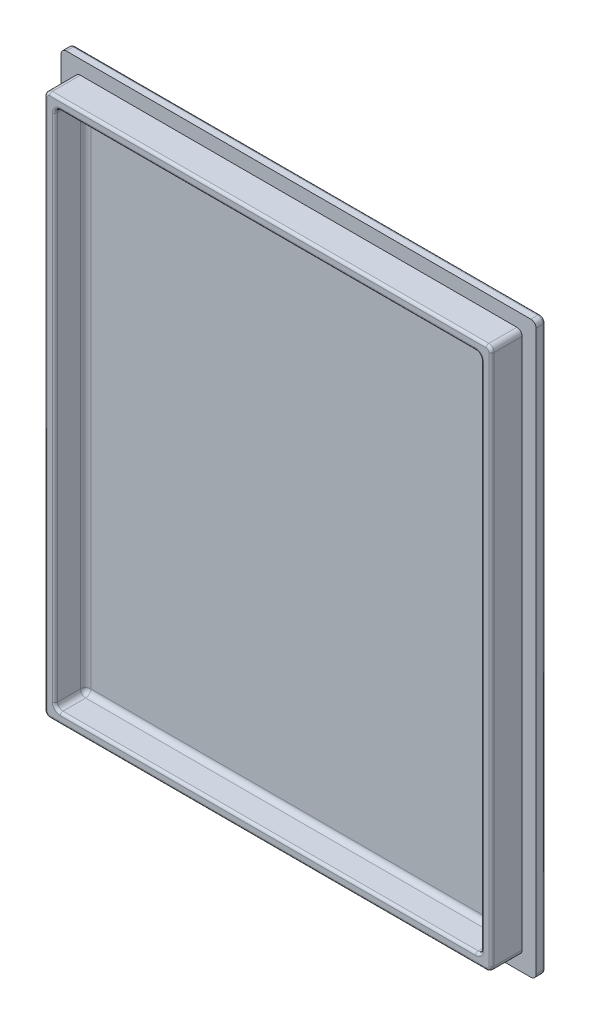
from build123d import *

# Parameters (mm, degrees)
SKETCH1_W           = 90
SKETCH1_H           = 108
BOSS_EXTRUDE1_DEPTH = 1.8
SKETCH2_W           = 84.7
SKETCH2_H           = 102.7
SKETCH2_W_2         = 80.7
SKETCH2_H_2         = 98.7
BOSS_EXTRUDE2_DEPTH = 5.8
FILLET1_R           = 1
FILLET2_R           = 0.5
CUT_EXTRUDE1_DEPTH  = 0.4


with BuildPart() as part:
    # Sketch1 → Boss-Extrude1 (new body)
    with BuildSketch(Plane.XY):
        Rectangle(SKETCH1_W, SKETCH1_H)
    extrude(amount=BOSS_EXTRUDE1_DEPTH)

    # Sketch2 → Boss-Extrude2 (add)
    with BuildSketch(Plane.XY.offset(1.8)):
        Rectangle(SKETCH2_W, SKETCH2_H)
        Rectangle(SKETCH2_W_2, SKETCH2_H_2, mode=Mode.SUBTRACT)
    extrude(amount=BOSS_EXTRUDE2_DEPTH)

    # Fillet1
    fillet1_edges = [part.edges().sort_by_distance(p)[0] for p in [
        (-40.35, 0, 1.8),
        (0, -49.35, 1.8),
        (40.35, 0, 1.8),
        (0, 49.35, 1.8),
        (-42.35, 51.35, 4.7),
        (-42.35, -51.35, 4.7),
        (42.35, -51.35, 4.7),
        (42.35, 51.35, 4.7),
        (-40.35, -49.35, 4.7),
        (40.35, -49.35, 4.7),
        (40.35, 49.35, 4.7),
        (-40.35, 49.35, 4.7),
        (45, -54, 0.9),
        (-45, -54, 0.9),
        (-45, 54, 0.9),
        (45, 54, 0.9),
    ]]
    fillet(fillet1_edges, radius=FILLET1_R)

    # Fillet2
    fillet2_edges = [part.edges().sort_by_distance(p)[0] for p in [
        (0, 49.35, 7.6),
        (40.35, 0, 7.6),
        (0, -49.35, 7.6),
        (-40.35, 0, 7.6),
        (0, -54, 0),
        (45, 0, 0),
        (-45, 0, 0),
        (0, 54, 0),
        (44.707106781, 53.707106781, 0),
        (44.707106781, -53.707106781, 0),
        (-44.707106781, 53.707106781, 0),
        (-44.707106781, -53.707106781, 0),
        (-42.35, 0, 7.6),
        (0, 51.35, 7.6),
        (0, -51.35, 7.6),
        (42.35, 0, 7.6),
        (42.057106781, 51.057106781, 7.6),
        (-42.057106781, -51.057106781, 7.6),
        (42.057106781, -51.057106781, 7.6),
        (-42.057106781, 51.057106781, 7.6),
        (40.057106781, -49.057106781, 7.6),
        (40.057106781, 49.057106781, 7.6),
        (-40.057106781, 49.057106781, 7.6),
        (-40.057106781, -49.057106781, 7.6),
    ]]
    fillet(fillet2_edges, radius=FILLET2_R)

    # Sketch3 → Cut-Extrude1 (cut)
    # profile 1 of 22: a face of its own
    with BuildSketch(Plane(origin=(0, 0, 0), x_dir=(-1, 0, 0), z_dir=(0, 0, -1))):
        with BuildLine():
            Line((-30.046875, 15.515625), (-30.046875, 11.715820313))
            add(Edge.make_bspline(
                [(-30.046875, 11.715820313), (-30.047557345, 11.636716191), (-30.048871794, 11.484332417), (-30.05548083, 11.264953882), (-30.069246102, 11.063773405), (-30.085589204, 10.877782305), (-30.112940714, 10.700218671), (-30.15008362, 10.524535589), (-30.203755596, 10.348311449), (-30.247407391, 10.232192122), (-30.26953125, 10.173339844)],
                knots=[0, 0, 0, 0, 1.210006368, 2.330919474, 3.356323987, 4.294191784, 5.185681834, 6.102709867, 7.038404292, 8, 8, 8, 8], degree=3))
            add(Edge.make_bspline(
                [(-30.26953125, 10.173339844), (-30.290338092, 10.12468765), (-30.331593248, 10.028221597), (-30.404876243, 9.890152603), (-30.489008033, 9.760522873), (-30.58269712, 9.639129424), (-30.685611034, 9.525508325), (-30.798838922, 9.421041247), (-30.92272024, 9.326318283), (-31.053992641, 9.237687704), (-31.195720277, 9.160534085), (-31.344841796, 9.090804071), (-31.503614251, 9.034506684), (-31.669918781, 8.987206239), (-31.844716369, 8.950938755), (-32.028101886, 8.92422726), (-32.220000118, 8.910313129), (-32.350566934, 8.907620077), (-32.416992187, 8.90625)],
                knots=[0, 0, 0, 0, 0.953881119, 1.891325734, 2.814479008, 3.737296314, 4.653537642, 5.575724681, 6.510892384, 7.463268797, 8.428782058, 9.417619489, 10.428630225, 11.462688628, 12.533322677, 13.645265432, 14.802039852, 16, 16, 16, 16], degree=3))
            add(Edge.make_bspline(
                [(-32.416992187, 8.90625), (-32.534785854, 8.909094695), (-32.760883214, 8.914554905), (-33.085542348, 8.95497497), (-33.379677086, 9.02433692), (-33.645019511, 9.122444802), (-33.883084533, 9.25358607), (-34.095856644, 9.419289536), (-34.284684073, 9.620731232), (-34.386512586, 9.776154768), (-34.438476562, 9.85546875)],
                knots=[0, 0, 0, 0, 1.20378012, 2.310578459, 3.337050898, 4.286231469, 5.193170284, 6.103603796, 7.032252521, 8, 8, 8, 8], degree=3))
            add(Edge.make_bspline(
                [(-34.438476562, 9.85546875), (-34.463920551, 9.903534711), (-34.515856845, 10.001646994), (-34.584907219, 10.15687609), (-34.64388007, 10.323449667), (-34.698757529, 10.496787548), (-34.739726129, 10.67431652), (-34.770992208, 10.849767363), (-34.791248266, 11.021007189), (-34.793383023, 11.134224253), (-34.794433594, 11.189941406)],
                knots=[0, 0, 0, 0, 0.935734867, 1.910022864, 2.920068211, 3.975205631, 5.037046427, 6.052390226, 7.041529002, 8, 8, 8, 8], degree=3))
            add(Edge.make_bspline(
                [(-34.794433594, 11.189941406), (-34.792578556, 11.244857696), (-34.789052635, 11.349238606), (-34.752122514, 11.495340285), (-34.690985175, 11.620870466), (-34.606374301, 11.725409805), (-34.500743751, 11.805478696), (-34.38202531, 11.865897996), (-34.248394555, 11.899646744), (-34.15545527, 11.904000083), (-34.107421875, 11.90625)],
                knots=[0, 0, 0, 0, 1.173039851, 2.229629267, 3.196748628, 4.139814058, 5.078064495, 6.012468433, 6.97279296, 8, 8, 8, 8], degree=3))
            add(Edge.make_bspline(
                [(-34.107421875, 11.90625), (-34.061803691, 11.904596289), (-33.974658017, 11.90143716), (-33.853138646, 11.869257072), (-33.748850533, 11.815200792), (-33.663143342, 11.737147007), (-33.592022485, 11.63718651), (-33.532740604, 11.514308798), (-33.479973667, 11.369060569), (-33.454449109, 11.262529301), (-33.440917969, 11.206054688)],
                knots=[0, 0, 0, 0, 1.023367024, 1.954966223, 2.799238581, 3.63850462, 4.533990685, 5.539973533, 6.695884835, 8, 8, 8, 8], degree=3))
            add(Edge.make_bspline(
                [(-33.440917969, 11.206054688), (-33.42718378, 11.144914824), (-33.401170396, 11.029112225), (-33.35762025, 10.865893274), (-33.318042144, 10.721076868), (-33.275393042, 10.593159598), (-33.225436737, 10.478674619), (-33.161392429, 10.374670133), (-33.083121465, 10.279116537), (-32.99092666, 10.191407055), (-32.879536275, 10.117675153), (-32.746132689, 10.067099929), (-32.593207248, 10.036235685), (-32.484536325, 10.032971072), (-32.427246094, 10.03125)],
                knots=[0, 0, 0, 0, 1.306183455, 2.473990433, 3.521252936, 4.435448757, 5.282948158, 6.119186039, 6.972897879, 7.851491932, 8.763418147, 9.736895206, 10.806913645, 12, 12, 12, 12], degree=3))
            add(Edge.make_bspline(
                [(-32.427246094, 10.03125), (-32.387659933, 10.032486396), (-32.311072875, 10.034878443), (-32.199531519, 10.050162936), (-32.097086909, 10.080879121), (-31.999980134, 10.11784165), (-31.912251174, 10.169828268), (-31.831846007, 10.232622181), (-31.758039178, 10.305673821), (-31.694090089, 10.391895351), (-31.635889144, 10.487495745), (-31.588594918, 10.595995186), (-31.54544516, 10.714023437), (-31.512912526, 10.844393413), (-31.484312932, 10.984948151), (-31.465874477, 11.137268742), (-31.456223585, 11.300653907), (-31.454180977, 11.413073354), (-31.453125, 11.471191406)],
                knots=[0, 0, 0, 0, 0.963361052, 1.863807676, 2.728602533, 3.560208343, 4.385341088, 5.19798089, 6.037943909, 6.902738766, 7.80318539, 8.754830499, 9.776827693, 10.857282673, 12.019774497, 13.264791246, 14.58596523, 16, 16, 16, 16], degree=3))
            Line((-31.453125, 11.471191406), (-31.453125, 15.509765625))
            add(Edge.make_bspline(
                [(-31.453125, 15.509765625), (-31.451198678, 15.579771909), (-31.447560429, 15.711992941), (-31.412453824, 15.896207675), (-31.356822294, 16.054710678), (-31.273227148, 16.183627886), (-31.168830369, 16.283627792), (-31.047011623, 16.356608249), (-30.906873086, 16.397876859), (-30.808371867, 16.403391876), (-30.757324219, 16.40625)],
                knots=[0, 0, 0, 0, 1.305302689, 2.465328236, 3.486148504, 4.421450945, 5.30454368, 6.162639947, 7.047799498, 8, 8, 8, 8], degree=3))
            add(Edge.make_bspline(
                [(-30.757324219, 16.40625), (-30.705198234, 16.404281792), (-30.604870923, 16.400493565), (-30.463804311, 16.35541414), (-30.338264323, 16.286101068), (-30.233223174, 16.185172275), (-30.147389594, 16.05737771), (-30.089109154, 15.900439469), (-30.051844022, 15.717070978), (-30.04860254, 15.585660121), (-30.046875, 15.515625)],
                knots=[0, 0, 0, 0, 0.965391849, 1.858097617, 2.723685037, 3.609584463, 4.538324685, 5.561246394, 6.700271746, 8, 8, 8, 8], degree=3))
        make_face()
    # profile 2 of 22: a face of its own
    with BuildSketch(Plane(origin=(0, 0, 0), x_dir=(-1, 0, 0), z_dir=(0, 0, -1))):
        with BuildLine():
            add(Edge.make_bspline(
                [(-25.196777344, 16.40625), (-25.103953521, 16.404946936), (-24.921943649, 16.402391876), (-24.654042029, 16.379230949), (-24.395663714, 16.344853051), (-24.14698363, 16.295369892), (-23.908618689, 16.23080155), (-23.680523501, 16.151445937), (-23.462404142, 16.057565898), (-23.254005513, 15.951003325), (-23.057616886, 15.830374847), (-22.871987867, 15.698461366), (-22.699221039, 15.553327636), (-22.538913675, 15.396247639), (-22.392088564, 15.226792777), (-22.256611177, 15.045903933), (-22.133525117, 14.852563577), (-22.024156057, 14.64681279), (-21.925895348, 14.431725901), (-21.840598478, 14.206672522), (-21.76940633, 13.972606101), (-21.710189819, 13.729138911), (-21.665309693, 13.476627294), (-21.633696839, 13.214479864), (-21.611811164, 12.943730614), (-21.610194942, 12.759810325), (-21.609375, 12.666503906)],
                knots=[0, 0, 0, 0, 1.137132438, 2.22970057, 3.292424762, 4.329649132, 5.333981859, 6.315987487, 7.286185149, 8.241436353, 9.181332131, 10.107725602, 11.0292572, 11.943085262, 12.854854597, 13.773819033, 14.709898734, 15.660115542, 16.626635295, 17.605574315, 18.606712189, 19.622473761, 20.67399022, 21.747038223, 22.857027702, 24, 24, 24, 24], degree=3))
            add(Edge.make_bspline(
                [(-21.609375, 12.666503906), (-21.612236463, 12.529681291), (-21.617850987, 12.261219335), (-21.660438971, 11.868195898), (-21.732633965, 11.494071676), (-21.830958179, 11.138998428), (-21.960192421, 10.805434355), (-22.117419853, 10.493817511), (-22.304187292, 10.205652032), (-22.518482598, 9.94119842), (-22.759486365, 9.7019547), (-23.028845105, 9.493389262), (-23.324888454, 9.315378239), (-23.644986712, 9.165436009), (-23.991057114, 9.047298892), (-24.362398942, 8.967874715), (-24.756718598, 8.913817681), (-25.028127226, 8.908817378), (-25.167480469, 8.90625)],
                knots=[0, 0, 0, 0, 1.119700056, 2.196982321, 3.230778928, 4.235358115, 5.208318876, 6.153781848, 7.087131445, 8.013361148, 8.934611457, 9.860297843, 10.794468433, 11.756326826, 12.748403726, 13.780058436, 14.860183413, 16, 16, 16, 16], degree=3))
            add(Edge.make_bspline(
                [(-25.167480469, 8.90625), (-25.305829686, 8.90958087), (-25.576673384, 8.916101654), (-25.971499241, 8.968354297), (-26.34481766, 9.052410131), (-26.69449719, 9.172594274), (-27.018095269, 9.325643475), (-27.316968746, 9.503792079), (-27.585319121, 9.714243232), (-27.826593308, 9.950989751), (-28.04077208, 10.214405028), (-28.222857641, 10.505794659), (-28.38344225, 10.818816651), (-28.510373607, 11.158114006), (-28.611361061, 11.516325766), (-28.68253515, 11.890781818), (-28.725931166, 12.279247212), (-28.73153067, 12.542855196), (-28.734375, 12.676757813)],
                knots=[0, 0, 0, 0, 1.130091603, 2.212359386, 3.247930852, 4.252250901, 5.226719473, 6.16821431, 7.089197795, 8.00610207, 8.925165125, 9.855999165, 10.808795857, 11.79501972, 12.810514548, 13.846493258, 14.906102224, 16, 16, 16, 16], degree=3))
            add(Edge.make_bspline(
                [(-28.734375, 12.676757813), (-28.731794897, 12.813123311), (-28.726721491, 13.081266672), (-28.679880961, 13.474123592), (-28.605926211, 13.850241465), (-28.500515847, 14.207726794), (-28.36686457, 14.544068229), (-28.20464001, 14.855597765), (-28.016818058, 15.141349776), (-27.80215582, 15.400780424), (-27.560312411, 15.632310235), (-27.292640828, 15.834794061), (-27.000458652, 16.008973051), (-26.683752456, 16.152238026), (-26.343963136, 16.267227072), (-25.981179063, 16.348412804), (-25.596082294, 16.397596314), (-25.332181227, 16.403315544), (-25.196777344, 16.40625)],
                knots=[0, 0, 0, 0, 1.125218611, 2.212582392, 3.260701818, 4.286054269, 5.284468473, 6.243521648, 7.180287843, 8.101949555, 9.017004541, 9.937572836, 10.866572707, 11.818894766, 12.801573564, 13.82236102, 14.882684417, 16, 16, 16, 16], degree=3))
        make_face()
        with BuildLine():
            add(Edge.make_bspline(
                [(-23.109375, 12.676757813), (-23.112239567, 12.807290522), (-23.117786032, 13.060032098), (-23.166943085, 13.425641394), (-23.246562329, 13.764762036), (-23.341458535, 14.027343783), (-23.432582367, 14.221981754), (-23.507003023, 14.357450361), (-23.587057743, 14.484987604), (-23.677918083, 14.600344408), (-23.772168099, 14.709023688), (-23.874210567, 14.808462676), (-23.984223246, 14.897180755), (-24.13838782, 15.00486256), (-24.34599589, 15.11643983), (-24.614050789, 15.21204985), (-24.899787334, 15.270968536), (-25.096394289, 15.27777485), (-25.196777344, 15.28125)],
                knots=[0, 0, 0, 0, 1.663767962, 3.22144036, 4.693807908, 6.09809827, 6.772124886, 7.43249818, 8.068074837, 8.689496673, 9.30272399, 9.901527182, 10.503429657, 11.102750509, 12.297797107, 13.495176895, 14.721094103, 16, 16, 16, 16], degree=3))
            add(Edge.make_bspline(
                [(-25.196777344, 15.28125), (-25.268683164, 15.279461327), (-25.410798157, 15.275926186), (-25.61941784, 15.242353303), (-25.819816768, 15.189848909), (-26.011062575, 15.116413025), (-26.19145206, 15.022631636), (-26.360178234, 14.908774737), (-26.515206508, 14.775285571), (-26.657404638, 14.622704684), (-26.785922851, 14.449494607), (-26.899942435, 14.253858622), (-26.99928744, 14.035794097), (-27.083982869, 13.797246773), (-27.150968666, 13.539443302), (-27.198598961, 13.265086624), (-27.228520242, 12.97575706), (-27.232394389, 12.77790652), (-27.234375, 12.676757813)],
                knots=[0, 0, 0, 0, 0.926902171, 1.831933723, 2.71800685, 3.595261319, 4.468550136, 5.334998465, 6.214894287, 7.1017058, 8.020008637, 8.99111482, 10.01694856, 11.106630737, 12.25237115, 13.448355624, 14.695502513, 16, 16, 16, 16], degree=3))
            add(Edge.make_bspline(
                [(-27.234375, 12.676757813), (-27.232388921, 12.574634374), (-27.22850333, 12.374838703), (-27.198643118, 12.082573109), (-27.150701899, 11.804885811), (-27.084194453, 11.542926095), (-26.998152674, 11.299747953), (-26.89486427, 11.077579628), (-26.779073356, 10.874836419), (-26.642473979, 10.697171482), (-26.494923833, 10.540390834), (-26.336350989, 10.403835916), (-26.167899684, 10.287505513), (-25.987956828, 10.192801372), (-25.7975089, 10.121743717), (-25.598661191, 10.067891189), (-25.390122793, 10.037132148), (-25.248143622, 10.033226935), (-25.176269531, 10.03125)],
                knots=[0, 0, 0, 0, 1.300369924, 2.54406124, 3.737115199, 4.88637188, 5.981883645, 7.016846829, 8.003376514, 8.948590554, 9.863559023, 10.741055788, 11.608647785, 12.46534091, 13.323432129, 14.192248925, 15.0848625, 16, 16, 16, 16], degree=3))
            add(Edge.make_bspline(
                [(-25.176269531, 10.03125), (-25.083697318, 10.034350516), (-24.901298636, 10.040459585), (-24.634218732, 10.097499603), (-24.379042185, 10.187181804), (-24.176997685, 10.290442989), (-24.024721749, 10.392161634), (-23.914681757, 10.477977168), (-23.812383256, 10.575631145), (-23.714874132, 10.681353913), (-23.624519148, 10.797450754), (-23.538971461, 10.922449348), (-23.459987404, 11.057686013), (-23.386913423, 11.20240464), (-23.32092258, 11.35634196), (-23.263363298, 11.519089161), (-23.217478217, 11.691361703), (-23.177430966, 11.87155969), (-23.146965096, 12.060868402), (-23.125300865, 12.25838107), (-23.111726827, 12.464653338), (-23.11017111, 12.604958952), (-23.109375, 12.676757813)],
                knots=[0, 0, 0, 0, 1.468568495, 2.893578421, 4.316075305, 5.755382189, 6.482330971, 7.222315454, 7.968369796, 8.725783183, 9.504530818, 10.302500265, 11.129737207, 11.9897977, 12.875655565, 13.787998707, 14.728608307, 15.705132475, 16.718642732, 17.771954593, 18.859838044, 20, 20, 20, 20], degree=3))
        make_face(mode=Mode.SUBTRACT)
    # profile 3 of 22: a face of its own
    with BuildSketch(Plane(origin=(0, 0, 0), x_dir=(-1, 0, 0), z_dir=(0, 0, -1))):
        with BuildLine():
            Line((-20.296875, 12.027832031), (-20.296875, 15.515625))
            add(Edge.make_bspline(
                [(-20.296875, 15.515625), (-20.295146872, 15.585659194), (-20.291904287, 15.717068313), (-20.254646403, 15.900448225), (-20.196342562, 16.057349593), (-20.110585709, 16.185265064), (-20.005897158, 16.285184075), (-19.883477802, 16.355161602), (-19.74723779, 16.400231352), (-19.650757558, 16.404204165), (-19.601074219, 16.40625)],
                knots=[0, 0, 0, 0, 1.314006093, 2.465543923, 3.499702682, 4.438645347, 5.334276599, 6.193453487, 7.069703068, 8, 8, 8, 8], degree=3))
            add(Edge.make_bspline(
                [(-19.601074219, 16.40625), (-19.549034135, 16.403455419), (-19.449054319, 16.398086448), (-19.306801493, 16.356239043), (-19.182532819, 16.284192332), (-19.076378706, 16.183727671), (-18.991638804, 16.054577579), (-18.932287764, 15.896710235), (-18.895926176, 15.712094468), (-18.892459288, 15.579774509), (-18.890625, 15.509765625)],
                knots=[0, 0, 0, 0, 0.96282878, 1.849794185, 2.716851436, 3.599658085, 4.532680285, 5.552030856, 6.704809248, 8, 8, 8, 8], degree=3))
            Line((-18.890625, 15.509765625), (-18.890625, 11.919433594))
            add(Edge.make_bspline(
                [(-18.890625, 11.919433594), (-18.88896099, 11.821235593), (-18.885776139, 11.633288482), (-18.861153533, 11.363416244), (-18.819555534, 11.1187183), (-18.760828211, 10.897681447), (-18.678607307, 10.700229845), (-18.569297614, 10.526335706), (-18.432260767, 10.376345914), (-18.297208954, 10.271477757), (-18.175605283, 10.202089325), (-18.074446639, 10.156508461), (-17.96508357, 10.116486396), (-17.845931107, 10.087122695), (-17.719499161, 10.061336401), (-17.583817451, 10.044800712), (-17.439696126, 10.031996788), (-17.340363977, 10.031502733), (-17.289550781, 10.03125)],
                knots=[0, 0, 0, 0, 1.640841622, 3.140506311, 4.523579023, 5.784571649, 6.954579444, 8.084197464, 9.198982671, 10.333306227, 10.925380769, 11.535182691, 12.185613052, 12.868404783, 13.583722754, 14.340779317, 15.151228418, 16, 16, 16, 16], degree=3))
            add(Edge.make_bspline(
                [(-17.289550781, 10.03125), (-17.219652438, 10.032488531), (-17.084856951, 10.034876977), (-16.890998029, 10.057752844), (-16.712341472, 10.09118436), (-16.55058932, 10.143143292), (-16.403631665, 10.207455987), (-16.27278386, 10.286362126), (-16.157477736, 10.380206623), (-16.058606607, 10.489666249), (-15.975165921, 10.615094367), (-15.901342478, 10.753195607), (-15.840494884, 10.90684669), (-15.789005599, 11.074238926), (-15.749767614, 11.257064412), (-15.72257464, 11.454387413), (-15.706561042, 11.666727531), (-15.704297139, 11.812959872), (-15.703125, 11.888671875)],
                knots=[0, 0, 0, 0, 1.187087794, 2.289239917, 3.312641325, 4.270309596, 5.169103343, 6.032749862, 6.858132282, 7.686303516, 8.528484611, 9.411791075, 10.342302716, 11.33164497, 12.384483705, 13.515514569, 14.713654137, 16, 16, 16, 16], degree=3))
            Line((-15.703125, 11.888671875), (-15.703125, 15.509765625))
            add(Edge.make_bspline(
                [(-15.703125, 15.509765625), (-15.701152924, 15.58071911), (-15.697452358, 15.713862034), (-15.663337742, 15.899799065), (-15.603711168, 16.056902331), (-15.519877824, 16.185081109), (-15.416203048, 16.286081405), (-15.292874569, 16.354713587), (-15.155530557, 16.400621444), (-15.058014651, 16.404324887), (-15.007324219, 16.40625)],
                knots=[0, 0, 0, 0, 1.324209478, 2.484855026, 3.512713035, 4.440887327, 5.324452051, 6.186293477, 7.057204391, 8, 8, 8, 8], degree=3))
            add(Edge.make_bspline(
                [(-15.007324219, 16.40625), (-14.956671237, 16.404202394), (-14.858292888, 16.400225529), (-14.719194495, 16.355185457), (-14.594438226, 16.285696562), (-14.487288029, 16.186407102), (-14.398792471, 16.059395029), (-14.338347826, 15.901296805), (-14.302150757, 15.716002986), (-14.298704393, 15.583193193), (-14.296875, 15.512695313)],
                knots=[0, 0, 0, 0, 0.937671153, 1.821147261, 2.686184232, 3.571984669, 4.510357278, 5.535961965, 6.692043289, 8, 8, 8, 8], degree=3))
            Line((-14.296875, 15.512695313), (-14.296875, 12.01171875))
            add(Edge.make_bspline(
                [(-14.296875, 12.01171875), (-14.298847418, 11.875440511), (-14.302634598, 11.613776875), (-14.331025919, 11.238859506), (-14.380669028, 10.899209785), (-14.447767244, 10.590603142), (-14.545113897, 10.307585952), (-14.678978125, 10.045710465), (-14.8472184, 9.800451933), (-14.984745128, 9.655972949), (-15.054199219, 9.583007812)],
                knots=[0, 0, 0, 0, 1.248457049, 2.397123805, 3.441600438, 4.391152342, 5.286682789, 6.174943873, 7.078305605, 8, 8, 8, 8], degree=3))
            add(Edge.make_bspline(
                [(-15.054199219, 9.583007812), (-15.120850225, 9.526699466), (-15.253996226, 9.414214574), (-15.4758685, 9.2744411), (-15.711986229, 9.155694832), (-15.965597237, 9.06195424), (-16.238167591, 8.991788363), (-16.53129762, 8.943057854), (-16.845996679, 8.911603727), (-17.063397501, 8.908069206), (-17.175292969, 8.90625)],
                knots=[0, 0, 0, 0, 0.917673777, 1.83319953, 2.752815171, 3.696261941, 4.673826777, 5.7116717, 6.822205161, 8, 8, 8, 8], degree=3))
            add(Edge.make_bspline(
                [(-17.175292969, 8.90625), (-17.308186532, 8.908418141), (-17.564660384, 8.91260248), (-17.93511442, 8.946819482), (-18.27736461, 9.000763176), (-18.59120097, 9.079938307), (-18.878262837, 9.181043198), (-19.135648971, 9.311731691), (-19.369128309, 9.462019208), (-19.572900799, 9.641592073), (-19.750514215, 9.846119646), (-19.903066164, 10.076717487), (-20.026178722, 10.335476681), (-20.128810633, 10.619242222), (-20.202434746, 10.93170181), (-20.258734422, 11.271218718), (-20.289861091, 11.640049288), (-20.294480639, 11.895453394), (-20.296875, 12.027832031)],
                knots=[0, 0, 0, 0, 1.244583114, 2.401944964, 3.48169555, 4.486712429, 5.430003149, 6.325898902, 7.184706889, 8.024138875, 8.860562605, 9.715550095, 10.605366032, 11.538500779, 12.536866304, 13.60758979, 14.759988597, 16, 16, 16, 16], degree=3))
        make_face()
    # profile 4 of 22: a face of its own
    with BuildSketch(Plane(origin=(0, 0, 0), x_dir=(-1, 0, 0), z_dir=(0, 0, -1))):
        with BuildLine():
            Line((-11.296875, 15.512695313), (-11.296875, 10.21875))
            Line((-11.296875, 10.21875), (-8.3203125, 10.21875))
            add(Edge.make_bspline(
                [(-8.3203125, 10.21875), (-8.264431535, 10.2172871), (-8.157869972, 10.21449744), (-8.008886269, 10.180012338), (-7.878365392, 10.126654826), (-7.772834862, 10.047307781), (-7.687774219, 9.954500459), (-7.6259966, 9.848349045), (-7.589861841, 9.729833876), (-7.585649643, 9.647218716), (-7.583496094, 9.604980469)],
                knots=[0, 0, 0, 0, 1.240270116, 2.365118784, 3.381765818, 4.352609133, 5.275186246, 6.165500839, 7.062084633, 8, 8, 8, 8], degree=3))
            add(Edge.make_bspline(
                [(-7.583496094, 9.604980469), (-7.585561979, 9.561752756), (-7.589558199, 9.478133635), (-7.626039798, 9.358706914), (-7.687084611, 9.253351492), (-7.771067036, 9.162506629), (-7.87646589, 9.087417874), (-8.006390887, 9.037559482), (-8.156046934, 9.004345058), (-8.263463127, 9.001503747), (-8.3203125, 9)],
                knots=[0, 0, 0, 0, 0.961785517, 1.860465312, 2.752861249, 3.654173772, 4.599371787, 5.609990076, 6.735101654, 8, 8, 8, 8], degree=3))
            Line((-8.3203125, 9), (-11.841796875, 9))
            add(Edge.make_bspline(
                [(-11.841796875, 9), (-11.913358444, 9.001872359), (-12.046633409, 9.005359406), (-12.230453231, 9.047257735), (-12.384993007, 9.111499373), (-12.508127522, 9.209140298), (-12.598882716, 9.339200098), (-12.660985106, 9.499737551), (-12.69609223, 9.691860425), (-12.700673411, 9.829924512), (-12.703125, 9.903808594)],
                knots=[0, 0, 0, 0, 1.184943227, 2.206816713, 3.109923682, 3.939837529, 4.776053014, 5.71019795, 6.774627611, 8, 8, 8, 8], degree=3))
            Line((-12.703125, 9.903808594), (-12.703125, 15.512695313))
            add(Edge.make_bspline(
                [(-12.703125, 15.512695313), (-12.701313102, 15.582702669), (-12.697900936, 15.714540511), (-12.661556645, 15.898264986), (-12.601718154, 16.054882387), (-12.517464455, 16.183837463), (-12.411607777, 16.283266003), (-12.290494557, 16.355976546), (-12.153046921, 16.397838828), (-12.056921996, 16.403387197), (-12.007324219, 16.40625)],
                knots=[0, 0, 0, 0, 1.312227502, 2.471186598, 3.495416453, 4.440711492, 5.33513045, 6.197779038, 7.0701043, 8, 8, 8, 8], degree=3))
            add(Edge.make_bspline(
                [(-12.007324219, 16.40625), (-11.956671214, 16.404202398), (-11.858292822, 16.400225541), (-11.71919474, 16.355185411), (-11.594437315, 16.285696733), (-11.487291612, 16.18640643), (-11.39877766, 16.059397807), (-11.338584055, 15.901735353), (-11.301906674, 15.716533127), (-11.298627552, 15.583692843), (-11.296875, 15.512695313)],
                knots=[0, 0, 0, 0, 0.937651975, 1.821110013, 2.686129292, 3.571911612, 4.510265029, 5.535848738, 6.683015045, 8, 8, 8, 8], degree=3))
        make_face()
    # profile 5 of 22: a face of its own
    with BuildSketch(Plane(origin=(0, 0, 0), x_dir=(-1, 0, 0), z_dir=(0, 0, -1))):
        with BuildLine():
            Line((-1.801757812, 15.09375), (-5.109375, 15.09375))
            Line((-5.109375, 15.09375), (-5.109375, 13.3125))
            Line((-5.109375, 13.3125), (-2.063964844, 13.3125))
            add(Edge.make_bspline(
                [(-2.063964844, 13.3125), (-2.011117234, 13.310499943), (-1.911919206, 13.306745721), (-1.773060758, 13.28019061), (-1.655625248, 13.231450001), (-1.560086538, 13.163434108), (-1.486712377, 13.07883871), (-1.432775125, 12.982400204), (-1.401242348, 12.872030031), (-1.397790918, 12.794639441), (-1.395996094, 12.754394531)],
                knots=[0, 0, 0, 0, 1.285293232, 2.412569968, 3.418386025, 4.354403319, 5.23810445, 6.120527863, 7.022630715, 8, 8, 8, 8], degree=3))
            add(Edge.make_bspline(
                [(-1.395996094, 12.754394531), (-1.397740492, 12.714124963), (-1.401094955, 12.636686953), (-1.433363054, 12.526458578), (-1.485309265, 12.427993789), (-1.557981242, 12.341619138), (-1.652728898, 12.271095052), (-1.770462135, 12.221139358), (-1.91029866, 12.192864126), (-2.010606243, 12.189362623), (-2.063964844, 12.1875)],
                knots=[0, 0, 0, 0, 0.971200242, 1.867609123, 2.749214551, 3.645234956, 4.57279535, 5.576919765, 6.711042891, 8, 8, 8, 8], degree=3))
            Line((-2.063964844, 12.1875), (-5.109375, 12.1875))
            Line((-5.109375, 12.1875), (-5.109375, 10.125))
            Line((-5.109375, 10.125), (-1.6875, 10.125))
            add(Edge.make_bspline(
                [(-1.6875, 10.125), (-1.63319901, 10.122968169), (-1.531118955, 10.119148545), (-1.387236267, 10.092772064), (-1.265305119, 10.042668469), (-1.164619379, 9.974077008), (-1.085050695, 9.889889618), (-1.030320035, 9.789782074), (-0.994768837, 9.678161067), (-0.991775762, 9.598915633), (-0.990234375, 9.558105469)],
                knots=[0, 0, 0, 0, 1.281412047, 2.408917619, 3.431661904, 4.368016538, 5.264760761, 6.136510243, 7.040331808, 8, 8, 8, 8], degree=3))
            add(Edge.make_bspline(
                [(-0.990234375, 9.558105469), (-0.991695332, 9.518240316), (-0.994514505, 9.441313508), (-1.030961541, 9.332899099), (-1.085446328, 9.234851522), (-1.164635373, 9.151028698), (-1.264965997, 9.081915175), (-1.38780435, 9.034572721), (-1.530847587, 9.005149913), (-1.633138565, 9.00178712), (-1.6875, 9)],
                knots=[0, 0, 0, 0, 0.944744106, 1.823049547, 2.692159438, 3.596595969, 4.540982691, 5.5681055, 6.707595947, 8, 8, 8, 8], degree=3))
            Line((-1.6875, 9), (-5.654296875, 9))
            add(Edge.make_bspline(
                [(-5.654296875, 9), (-5.725804653, 9.002080975), (-5.858872775, 9.00595344), (-6.043237929, 9.045290679), (-6.196909912, 9.110355932), (-6.321118482, 9.206076585), (-6.410913531, 9.336057185), (-6.473605385, 9.495218651), (-6.508568697, 9.686014754), (-6.513164554, 9.823096217), (-6.515625, 9.896484375)],
                knots=[0, 0, 0, 0, 1.189456171, 2.21344733, 3.119993849, 3.948013107, 4.78741338, 5.71757596, 6.778077714, 8, 8, 8, 8], degree=3))
            Line((-6.515625, 9.896484375), (-6.515625, 15.322265625))
            add(Edge.make_bspline(
                [(-6.515625, 15.322265625), (-6.514498817, 15.372605022), (-6.512360321, 15.46819391), (-6.496454894, 15.604644771), (-6.469392192, 15.726808639), (-6.429578673, 15.835249068), (-6.378749492, 15.93069899), (-6.312831114, 16.011481764), (-6.234050694, 16.077882297), (-6.143064409, 16.131754914), (-6.038548521, 16.170273646), (-5.92238, 16.200242008), (-5.792375128, 16.215198207), (-5.701689441, 16.217530919), (-5.654296875, 16.21875)],
                knots=[0, 0, 0, 0, 1.257097402, 2.387087425, 3.425508426, 4.374733264, 5.264346199, 6.113849079, 6.961774747, 7.825601221, 8.740599092, 9.73444991, 10.816017894, 12, 12, 12, 12], degree=3))
            Line((-5.654296875, 16.21875), (-1.801757812, 16.21875))
            add(Edge.make_bspline(
                [(-1.801757812, 16.21875), (-1.746987064, 16.216675053), (-1.643973643, 16.212772469), (-1.499335979, 16.187060865), (-1.378191279, 16.136257484), (-1.278484892, 16.068399777), (-1.20349846, 15.982992088), (-1.146534527, 15.886703102), (-1.114158188, 15.776432588), (-1.110673924, 15.698932363), (-1.108886719, 15.659179688)],
                knots=[0, 0, 0, 0, 1.304353081, 2.453241492, 3.474309848, 4.409392115, 5.298405909, 6.157667996, 7.055001114, 8, 8, 8, 8], degree=3))
            add(Edge.make_bspline(
                [(-1.108886719, 15.659179688), (-1.110604123, 15.618429598), (-1.113933066, 15.539441392), (-1.146973229, 15.427123703), (-1.202528613, 15.328430167), (-1.278639472, 15.242803261), (-1.377827533, 15.174443463), (-1.499743128, 15.125921841), (-1.643906037, 15.099570674), (-1.746963596, 15.095770499), (-1.801757812, 15.09375)],
                knots=[0, 0, 0, 0, 0.962139494, 1.864969442, 2.738963821, 3.622448103, 4.551714319, 5.562017248, 6.70375977, 8, 8, 8, 8], degree=3))
        make_face()
    # profile 6 of 22: a face of its own
    with BuildSketch(Plane(origin=(0, 0, 0), x_dir=(-1, 0, 0), z_dir=(0, 0, -1))):
        with BuildLine():
            Line((2.620605469, 10.117675781), (1.453125, 14.71875))
            Line((1.453125, 14.71875), (1.453125, 9.733886719))
            add(Edge.make_bspline(
                [(1.453125, 9.733886719), (1.451163245, 9.668749835), (1.447489199, 9.54675912), (1.413188001, 9.376307142), (1.359724399, 9.229820408), (1.278169338, 9.111056582), (1.179056204, 9.019120919), (1.064297993, 8.952094058), (0.933569679, 8.913493944), (0.84156456, 8.908720566), (0.793945313, 8.90625)],
                knots=[0, 0, 0, 0, 1.30362474, 2.441475632, 3.469867302, 4.406120522, 5.299256138, 6.158467928, 7.046875082, 8, 8, 8, 8], degree=3))
            add(Edge.make_bspline(
                [(0.793945313, 8.90625), (0.747757565, 8.908691748), (0.658092932, 8.913431931), (0.53054656, 8.953024995), (0.416284895, 9.01744071), (0.3164592, 9.108150803), (0.236686715, 9.22661659), (0.179180559, 9.371198343), (0.14672024, 9.542034987), (0.14274126, 9.664407277), (0.140625, 9.729492188)],
                knots=[0, 0, 0, 0, 0.931401934, 1.808137819, 2.66942439, 3.563139973, 4.50699297, 5.529036112, 6.685793447, 8, 8, 8, 8], degree=3))
            Line((0.140625, 9.729492188), (0.140625, 15.418945313))
            add(Edge.make_bspline(
                [(0.140625, 15.418945313), (0.141693797, 15.456558044), (0.143752136, 15.528994375), (0.153062178, 15.633065928), (0.172013883, 15.727933602), (0.199571614, 15.812328663), (0.234034786, 15.887490257), (0.274334833, 15.954215578), (0.324765517, 16.010520765), (0.403666005, 16.072024018), (0.518850908, 16.131811318), (0.675139918, 16.183106114), (0.852346815, 16.213569174), (0.977415483, 16.216968358), (1.04296875, 16.21875)],
                knots=[0, 0, 0, 0, 0.969665939, 1.867427353, 2.689218696, 3.457225703, 4.149776576, 4.816702983, 5.458338976, 6.085245707, 7.385799533, 8.77853966, 10.311509556, 12, 12, 12, 12], degree=3))
            Line((1.04296875, 16.21875), (1.492675781, 16.21875))
            add(Edge.make_bspline(
                [(1.492675781, 16.21875), (1.555677503, 16.217971496), (1.672566568, 16.216527112), (1.83389565, 16.204737268), (1.96732963, 16.181599944), (2.076809289, 16.150567842), (2.166381792, 16.104119941), (2.242333431, 16.045333315), (2.304916433, 15.969966516), (2.3557128, 15.877376607), (2.401037923, 15.763023607), (2.448342329, 15.622257402), (2.501671384, 15.45270676), (2.534255783, 15.328774602), (2.551757813, 15.262207031)],
                knots=[0, 0, 0, 0, 1.38803647, 2.575267475, 3.558583177, 4.368440808, 5.070869684, 5.768090105, 6.470518981, 7.212366556, 8.085347214, 9.177334938, 10.483864409, 12, 12, 12, 12], degree=3))
            Line((2.551757813, 15.262207031), (3.609375, 11.34375))
            Line((3.609375, 11.34375), (4.653808594, 15.262207031))
            add(Edge.make_bspline(
                [(4.653808594, 15.262207031), (4.671317323, 15.328770732), (4.703914195, 15.452695686), (4.75716393, 15.622292141), (4.804698511, 15.762925406), (4.849475473, 15.877873383), (4.902339556, 15.969556591), (4.964597525, 16.045395996), (5.040682503, 16.104082726), (5.130604019, 16.150877797), (5.241225087, 16.181498062), (5.376063462, 16.204749313), (5.538377211, 16.216479717), (5.655749899, 16.217957042), (5.71875, 16.21875)],
                knots=[0, 0, 0, 0, 1.511478991, 2.813995637, 3.902629473, 4.772928891, 5.517843496, 6.218114959, 6.913193965, 7.613465427, 8.431097637, 9.421953472, 10.616226692, 12, 12, 12, 12], degree=3))
            Line((5.71875, 16.21875), (6.169921875, 16.21875))
            add(Edge.make_bspline(
                [(6.169921875, 16.21875), (6.235956364, 16.216950866), (6.361981491, 16.213517264), (6.54025294, 16.183333312), (6.69689661, 16.131736577), (6.812346217, 16.072190372), (6.890990536, 16.010039501), (6.943209495, 15.954821325), (6.982720004, 15.886998806), (7.020108526, 15.813074532), (7.044181057, 15.727349105), (7.066445378, 15.633358422), (7.07478089, 15.528940032), (7.076982045, 15.45653947), (7.078125, 15.418945313)],
                knots=[0, 0, 0, 0, 1.69575107, 3.236297379, 4.624693315, 5.921190494, 6.546141798, 7.194208304, 7.859054455, 8.55478081, 9.316580419, 10.138397467, 11.033358612, 12, 12, 12, 12], degree=3))
            Line((7.078125, 15.418945313), (7.078125, 9.729492188))
            add(Edge.make_bspline(
                [(7.078125, 9.729492188), (7.076107366, 9.664858098), (7.072315375, 9.543383206), (7.03853212, 9.373712308), (6.984250429, 9.228107989), (6.903657988, 9.109583151), (6.803315588, 9.018746296), (6.687781664, 8.952068927), (6.555608252, 8.913503207), (6.462653721, 8.908723464), (6.414550781, 8.90625)],
                knots=[0, 0, 0, 0, 1.293518314, 2.431070022, 3.450077594, 4.386084638, 5.272371044, 6.139835868, 7.037385671, 8, 8, 8, 8], degree=3))
            add(Edge.make_bspline(
                [(6.414550781, 8.90625), (6.368866709, 8.908724674), (6.280189056, 8.913528281), (6.153576632, 8.952740898), (6.040971474, 9.019548319), (5.941913604, 9.110978892), (5.860821246, 9.230147755), (5.805085669, 9.37592739), (5.77141664, 9.546821252), (5.767641001, 9.668771463), (5.765625, 9.733886719)],
                knots=[0, 0, 0, 0, 0.922456205, 1.790585791, 2.649061979, 3.550299627, 4.495046019, 5.536376652, 6.684549498, 8, 8, 8, 8], degree=3))
            Line((5.765625, 9.733886719), (5.765625, 14.71875))
            Line((5.765625, 14.71875), (4.598144531, 10.117675781))
            add(Edge.make_bspline(
                [(4.598144531, 10.117675781), (4.580370765, 10.047775507), (4.547357379, 9.917941188), (4.497347939, 9.738885251), (4.452955389, 9.589626032), (4.415884391, 9.463760192), (4.370016012, 9.355500603), (4.311276125, 9.256212492), (4.234237503, 9.164124221), (4.147418805, 9.074142727), (4.040485957, 8.997614758), (3.913257449, 8.943411191), (3.767236728, 8.910972097), (3.663752659, 8.907876592), (3.609375, 8.90625)],
                knots=[0, 0, 0, 0, 1.501096557, 2.788170037, 3.868651286, 4.742863802, 5.516817816, 6.309819568, 7.133547599, 8.010237478, 8.906902995, 9.849006967, 10.869720086, 12, 12, 12, 12], degree=3))
            add(Edge.make_bspline(
                [(3.609375, 8.90625), (3.567776148, 8.907648329), (3.487461146, 8.910348087), (3.372227979, 8.931233613), (3.266244848, 8.964636329), (3.17086198, 9.013509138), (3.086090943, 9.073430603), (3.012224925, 9.14262275), (2.945330855, 9.216229389), (2.873214575, 9.328753833), (2.79971396, 9.483388771), (2.734581194, 9.685116273), (2.680839922, 9.899229464), (2.640915015, 10.044021164), (2.620605469, 10.117675781)],
                knots=[0, 0, 0, 0, 0.868933015, 1.67765103, 2.439282522, 3.183205666, 3.908055228, 4.601401517, 5.295498424, 5.980457608, 7.386244959, 8.861049734, 10.403235965, 12, 12, 12, 12], degree=3))
        make_face()
    # profile 7 of 22: a face of its own
    with BuildSketch(Plane(origin=(0, 0, 0), x_dir=(-1, 0, 0), z_dir=(0, 0, -1))):
        with BuildLine():
            Line((13.385742188, 15.09375), (10.078125, 15.09375))
            Line((10.078125, 15.09375), (10.078125, 13.3125))
            Line((10.078125, 13.3125), (13.123535156, 13.3125))
            add(Edge.make_bspline(
                [(13.123535156, 13.3125), (13.176382766, 13.310499943), (13.275580794, 13.306745721), (13.414439242, 13.28019061), (13.531874752, 13.231450001), (13.627413462, 13.163434108), (13.700787623, 13.07883871), (13.754724875, 12.982400204), (13.786257652, 12.872030031), (13.789709082, 12.794639441), (13.791503906, 12.754394531)],
                knots=[0, 0, 0, 0, 1.285293232, 2.412569968, 3.418386025, 4.354403319, 5.23810445, 6.120527863, 7.022630715, 8, 8, 8, 8], degree=3))
            add(Edge.make_bspline(
                [(13.791503906, 12.754394531), (13.789759508, 12.714124963), (13.786405045, 12.636686953), (13.754136946, 12.526458578), (13.702190735, 12.427993789), (13.629518758, 12.341619138), (13.534771102, 12.271095052), (13.417037865, 12.221139358), (13.27720134, 12.192864126), (13.176893757, 12.189362623), (13.123535156, 12.1875)],
                knots=[0, 0, 0, 0, 0.971200242, 1.867609123, 2.749214551, 3.645234956, 4.57279535, 5.576919765, 6.711042891, 8, 8, 8, 8], degree=3))
            Line((13.123535156, 12.1875), (10.078125, 12.1875))
            Line((10.078125, 12.1875), (10.078125, 10.125))
            Line((10.078125, 10.125), (13.5, 10.125))
            add(Edge.make_bspline(
                [(13.5, 10.125), (13.55430099, 10.122968169), (13.656381045, 10.119148545), (13.800263733, 10.092772064), (13.922194881, 10.042668469), (14.022880621, 9.974077008), (14.102449305, 9.889889618), (14.157179965, 9.789782074), (14.192731163, 9.678161067), (14.195724238, 9.598915633), (14.197265625, 9.558105469)],
                knots=[0, 0, 0, 0, 1.281412047, 2.408917619, 3.431661904, 4.368016538, 5.264760761, 6.136510243, 7.040331808, 8, 8, 8, 8], degree=3))
            add(Edge.make_bspline(
                [(14.197265625, 9.558105469), (14.195804668, 9.518240316), (14.192985495, 9.441313508), (14.156538459, 9.332899099), (14.102053672, 9.234851522), (14.022864627, 9.151028698), (13.922534003, 9.081915175), (13.79969565, 9.034572721), (13.656652413, 9.005149913), (13.554361435, 9.00178712), (13.5, 9)],
                knots=[0, 0, 0, 0, 0.944744106, 1.823049547, 2.692159438, 3.596595969, 4.540982691, 5.5681055, 6.707595947, 8, 8, 8, 8], degree=3))
            Line((13.5, 9), (9.533203125, 9))
            add(Edge.make_bspline(
                [(9.533203125, 9), (9.461695347, 9.002080975), (9.328627225, 9.00595344), (9.144262071, 9.045290679), (8.990590088, 9.110355932), (8.866381518, 9.206076585), (8.776586469, 9.336057185), (8.713894615, 9.495218651), (8.678931303, 9.686014754), (8.674335446, 9.823096217), (8.671875, 9.896484375)],
                knots=[0, 0, 0, 0, 1.189456171, 2.21344733, 3.119993849, 3.948013107, 4.78741338, 5.71757596, 6.778077714, 8, 8, 8, 8], degree=3))
            Line((8.671875, 9.896484375), (8.671875, 15.322265625))
            add(Edge.make_bspline(
                [(8.671875, 15.322265625), (8.673001183, 15.372605022), (8.675139679, 15.46819391), (8.691045106, 15.604644771), (8.718107808, 15.726808639), (8.757921327, 15.835249068), (8.808750508, 15.93069899), (8.874668886, 16.011481764), (8.953449306, 16.077882297), (9.044435591, 16.131754914), (9.148951479, 16.170273646), (9.26512, 16.200242008), (9.395124872, 16.215198207), (9.485810559, 16.217530919), (9.533203125, 16.21875)],
                knots=[0, 0, 0, 0, 1.257097402, 2.387087425, 3.425508426, 4.374733264, 5.264346199, 6.113849079, 6.961774747, 7.825601221, 8.740599092, 9.73444991, 10.816017894, 12, 12, 12, 12], degree=3))
            Line((9.533203125, 16.21875), (13.385742188, 16.21875))
            add(Edge.make_bspline(
                [(13.385742188, 16.21875), (13.440512936, 16.216675053), (13.543526357, 16.212772469), (13.688164021, 16.187060865), (13.809308721, 16.136257484), (13.909015108, 16.068399777), (13.98400154, 15.982992088), (14.040965473, 15.886703102), (14.073341812, 15.776432588), (14.076826076, 15.698932363), (14.078613281, 15.659179688)],
                knots=[0, 0, 0, 0, 1.304353081, 2.453241492, 3.474309848, 4.409392115, 5.298405909, 6.157667996, 7.055001114, 8, 8, 8, 8], degree=3))
            add(Edge.make_bspline(
                [(14.078613281, 15.659179688), (14.076895877, 15.618429598), (14.073566934, 15.539441392), (14.040526771, 15.427123703), (13.984971387, 15.328430167), (13.908860528, 15.242803261), (13.809672467, 15.174443463), (13.687756872, 15.125921841), (13.543593963, 15.099570674), (13.440536404, 15.095770499), (13.385742188, 15.09375)],
                knots=[0, 0, 0, 0, 0.962139494, 1.864969442, 2.738963821, 3.622448103, 4.551714319, 5.562017248, 6.70375977, 8, 8, 8, 8], degree=3))
        make_face()
    # profile 8 of 22: a face of its own
    with BuildSketch(Plane(origin=(0, 0, 0), x_dir=(-1, 0, 0), z_dir=(0, 0, -1))):
        with BuildLine():
            Line((20.022949219, 15), (18.421875, 15))
            Line((18.421875, 15), (18.421875, 9.791015625))
            add(Edge.make_bspline(
                [(18.421875, 9.791015625), (18.42013939, 9.720502201), (18.416893297, 9.588621684), (18.379957653, 9.404442133), (18.320135412, 9.247961374), (18.23301535, 9.121629325), (18.12741025, 9.024345632), (18.005461745, 8.955676441), (17.869046456, 8.912662506), (17.77278867, 8.908431899), (17.723144531, 8.90625)],
                knots=[0, 0, 0, 0, 1.324771526, 2.4777063, 3.516495944, 4.454151167, 5.338361256, 6.19400724, 7.068574513, 8, 8, 8, 8], degree=3))
            add(Edge.make_bspline(
                [(17.723144531, 8.90625), (17.672946266, 8.908241834), (17.575458722, 8.912110075), (17.438028731, 8.957982904), (17.312732282, 9.02502933), (17.2062143, 9.124797356), (17.117461868, 9.250929396), (17.05960542, 9.408332743), (17.02015072, 9.590329257), (17.017194286, 9.721427959), (17.015625, 9.791015625)],
                knots=[0, 0, 0, 0, 0.936591527, 1.818907611, 2.686883908, 3.580272073, 4.52668274, 5.549195867, 6.699104295, 8, 8, 8, 8], degree=3))
            Line((17.015625, 9.791015625), (17.015625, 15))
            Line((17.015625, 15), (15.413085938, 15))
            add(Edge.make_bspline(
                [(15.413085938, 15), (15.354286516, 15.001459012), (15.243966762, 15.004196417), (15.090850142, 15.037361517), (14.959444146, 15.087176836), (14.853117854, 15.162113809), (14.771755817, 15.254269878), (14.712330046, 15.359877437), (14.678512157, 15.479414633), (14.674130978, 15.563267432), (14.671875, 15.606445313)],
                knots=[0, 0, 0, 0, 1.298175259, 2.435642608, 3.448405227, 4.386245553, 5.281324188, 6.14672195, 7.045701294, 8, 8, 8, 8], degree=3))
            add(Edge.make_bspline(
                [(14.671875, 15.606445313), (14.673753122, 15.651668832), (14.677374715, 15.738873556), (14.715631041, 15.861081306), (14.775170078, 15.969153761), (14.860783705, 16.059266135), (14.968331929, 16.132486453), (15.098519699, 16.182912139), (15.249041324, 16.213880202), (15.356277809, 16.217063604), (15.413085938, 16.21875)],
                knots=[0, 0, 0, 0, 0.993926626, 1.916593339, 2.793690024, 3.692250099, 4.629614642, 5.63892321, 6.749228366, 8, 8, 8, 8], degree=3))
            Line((15.413085938, 16.21875), (20.022949219, 16.21875))
            add(Edge.make_bspline(
                [(20.022949219, 16.21875), (20.082711742, 16.217237573), (20.194939809, 16.214397386), (20.35079043, 16.181868084), (20.483924082, 16.130530466), (20.589673183, 16.053115831), (20.673856551, 15.961977628), (20.731619166, 15.854405284), (20.768492091, 15.734811641), (20.772396139, 15.650186389), (20.774414063, 15.606445313)],
                knots=[0, 0, 0, 0, 1.304496451, 2.449714448, 3.464685333, 4.39788137, 5.28974218, 6.154486031, 7.046091257, 8, 8, 8, 8], degree=3))
            add(Edge.make_bspline(
                [(20.774414063, 15.606445313), (20.772290521, 15.563235194), (20.768159764, 15.479181967), (20.732362798, 15.359728783), (20.67153107, 15.254179077), (20.588670058, 15.162052126), (20.480897807, 15.08718204), (20.347638554, 15.037139931), (20.192983617, 15.004460517), (20.081734147, 15.001542107), (20.022949219, 15)],
                knots=[0, 0, 0, 0, 0.94771637, 1.843517728, 2.708217129, 3.604275273, 4.544436114, 5.560171289, 6.710778986, 8, 8, 8, 8], degree=3))
        make_face()
    # profile 9 of 22: a face of its own
    with BuildSketch(Plane(origin=(0, 0, 0), x_dir=(-1, 0, 0), z_dir=(0, 0, -1))):
        with BuildLine():
            Line((26.510742188, 15.09375), (23.203125, 15.09375))
            Line((23.203125, 15.09375), (23.203125, 13.3125))
            Line((23.203125, 13.3125), (26.248535156, 13.3125))
            add(Edge.make_bspline(
                [(26.248535156, 13.3125), (26.301382766, 13.310499943), (26.400580794, 13.306745721), (26.539439242, 13.28019061), (26.656874752, 13.231450001), (26.752413462, 13.163434108), (26.825787623, 13.07883871), (26.879724875, 12.982400204), (26.911257652, 12.872030031), (26.914709082, 12.794639441), (26.916503906, 12.754394531)],
                knots=[0, 0, 0, 0, 1.285293232, 2.412569968, 3.418386025, 4.354403319, 5.23810445, 6.120527863, 7.022630715, 8, 8, 8, 8], degree=3))
            add(Edge.make_bspline(
                [(26.916503906, 12.754394531), (26.914759508, 12.714124963), (26.911405045, 12.636686953), (26.879136946, 12.526458578), (26.827190735, 12.427993789), (26.754518758, 12.341619138), (26.659771102, 12.271095052), (26.542037865, 12.221139358), (26.40220134, 12.192864126), (26.301893757, 12.189362623), (26.248535156, 12.1875)],
                knots=[0, 0, 0, 0, 0.971200242, 1.867609123, 2.749214551, 3.645234956, 4.57279535, 5.576919765, 6.711042891, 8, 8, 8, 8], degree=3))
            Line((26.248535156, 12.1875), (23.203125, 12.1875))
            Line((23.203125, 12.1875), (23.203125, 10.125))
            Line((23.203125, 10.125), (26.625, 10.125))
            add(Edge.make_bspline(
                [(26.625, 10.125), (26.67930099, 10.122968169), (26.781381045, 10.119148545), (26.925263733, 10.092772064), (27.047194881, 10.042668469), (27.147880621, 9.974077008), (27.227449305, 9.889889618), (27.282179965, 9.789782074), (27.317731163, 9.678161067), (27.320724238, 9.598915633), (27.322265625, 9.558105469)],
                knots=[0, 0, 0, 0, 1.281412047, 2.408917619, 3.431661904, 4.368016538, 5.264760761, 6.136510243, 7.040331808, 8, 8, 8, 8], degree=3))
            add(Edge.make_bspline(
                [(27.322265625, 9.558105469), (27.320804668, 9.518240316), (27.317985495, 9.441313508), (27.281538459, 9.332899099), (27.227053672, 9.234851522), (27.147864627, 9.151028698), (27.047534003, 9.081915175), (26.92469565, 9.034572721), (26.781652413, 9.005149913), (26.679361435, 9.00178712), (26.625, 9)],
                knots=[0, 0, 0, 0, 0.944744106, 1.823049547, 2.692159438, 3.596595969, 4.540982691, 5.5681055, 6.707595947, 8, 8, 8, 8], degree=3))
            Line((26.625, 9), (22.658203125, 9))
            add(Edge.make_bspline(
                [(22.658203125, 9), (22.586695347, 9.002080975), (22.453627225, 9.00595344), (22.269262071, 9.045290679), (22.115590088, 9.110355932), (21.991381518, 9.206076585), (21.901586469, 9.336057185), (21.838894615, 9.495218651), (21.803931303, 9.686014754), (21.799335446, 9.823096217), (21.796875, 9.896484375)],
                knots=[0, 0, 0, 0, 1.189456171, 2.21344733, 3.119993849, 3.948013107, 4.78741338, 5.71757596, 6.778077714, 8, 8, 8, 8], degree=3))
            Line((21.796875, 9.896484375), (21.796875, 15.322265625))
            add(Edge.make_bspline(
                [(21.796875, 15.322265625), (21.798001183, 15.372605022), (21.800139679, 15.46819391), (21.816045106, 15.604644771), (21.843107808, 15.726808639), (21.882921327, 15.835249068), (21.933750508, 15.93069899), (21.999668886, 16.011481764), (22.078449306, 16.077882297), (22.169435591, 16.131754914), (22.273951479, 16.170273646), (22.39012, 16.200242008), (22.520124872, 16.215198207), (22.610810559, 16.217530919), (22.658203125, 16.21875)],
                knots=[0, 0, 0, 0, 1.257097402, 2.387087425, 3.425508426, 4.374733264, 5.264346199, 6.113849079, 6.961774747, 7.825601221, 8.740599092, 9.73444991, 10.816017894, 12, 12, 12, 12], degree=3))
            Line((22.658203125, 16.21875), (26.510742188, 16.21875))
            add(Edge.make_bspline(
                [(26.510742188, 16.21875), (26.565512936, 16.216675053), (26.668526357, 16.212772469), (26.813164021, 16.187060865), (26.934308721, 16.136257484), (27.034015108, 16.068399777), (27.10900154, 15.982992088), (27.165965473, 15.886703102), (27.198341812, 15.776432588), (27.201826076, 15.698932363), (27.203613281, 15.659179688)],
                knots=[0, 0, 0, 0, 1.304353081, 2.453241492, 3.474309848, 4.409392115, 5.298405909, 6.157667996, 7.055001114, 8, 8, 8, 8], degree=3))
            add(Edge.make_bspline(
                [(27.203613281, 15.659179688), (27.201895877, 15.618429598), (27.198566934, 15.539441392), (27.165526771, 15.427123703), (27.109971387, 15.328430167), (27.033860528, 15.242803261), (26.934672467, 15.174443463), (26.812756872, 15.125921841), (26.668593963, 15.099570674), (26.565536404, 15.095770499), (26.510742188, 15.09375)],
                knots=[0, 0, 0, 0, 0.962139494, 1.864969442, 2.738963821, 3.622448103, 4.551714319, 5.562017248, 6.70375977, 8, 8, 8, 8], degree=3))
        make_face()
    # profile 10 of 22: a face of its own
    with BuildSketch(Plane(origin=(0, 0, 0), x_dir=(-1, 0, 0), z_dir=(0, 0, -1))):
        with BuildLine():
            Line((30.459960938, 12.09375), (29.953125, 12.09375))
            Line((29.953125, 12.09375), (29.953125, 9.791015625))
            add(Edge.make_bspline(
                [(29.953125, 9.791015625), (29.951340555, 9.72003442), (29.948001759, 9.587224682), (29.911801734, 9.402269946), (29.850881089, 9.246279361), (29.764795023, 9.120084226), (29.658113155, 9.02447997), (29.536402399, 8.955261821), (29.399228707, 8.91288694), (29.302549724, 8.908501042), (29.252929688, 8.90625)],
                knots=[0, 0, 0, 0, 1.331902197, 2.492062242, 3.520752585, 4.456973203, 5.333663409, 6.188000262, 7.069999586, 8, 8, 8, 8], degree=3))
            add(Edge.make_bspline(
                [(29.252929688, 8.90625), (29.199899281, 8.908941174), (29.097836642, 8.914120623), (28.954104783, 8.957097192), (28.829973218, 9.029851911), (28.725151549, 9.129976995), (28.643810087, 9.259391611), (28.587788087, 9.415259215), (28.552383735, 9.596082662), (28.548783326, 9.725402078), (28.546875, 9.793945313)],
                knots=[0, 0, 0, 0, 0.98783513, 1.901193439, 2.76656523, 3.649069121, 4.578809423, 5.590416226, 6.722847106, 8, 8, 8, 8], degree=3))
            Line((28.546875, 9.793945313), (28.546875, 15.326660156))
            add(Edge.make_bspline(
                [(28.546875, 15.326660156), (28.549021791, 15.399625978), (28.553049959, 15.536536633), (28.592106654, 15.725948742), (28.655614554, 15.885003676), (28.749541247, 16.012954427), (28.875964594, 16.108451079), (29.032999584, 16.1736645), (29.220780045, 16.212616629), (29.356237738, 16.216612246), (29.428710938, 16.21875)],
                knots=[0, 0, 0, 0, 1.204539147, 2.260157444, 3.178834964, 4.014831347, 4.849268471, 5.763683293, 6.803515522, 8, 8, 8, 8], degree=3))
            Line((29.428710938, 16.21875), (31.766601563, 16.21875))
            add(Edge.make_bspline(
                [(31.766601563, 16.21875), (31.844239725, 16.218038708), (31.993692393, 16.216669478), (32.209703362, 16.210427543), (32.407976376, 16.195187451), (32.590832525, 16.176541838), (32.760676726, 16.151563134), (32.919901079, 16.112205067), (33.071604938, 16.065439745), (33.166870137, 16.02292625), (33.213867188, 16.001953125)],
                knots=[0, 0, 0, 0, 1.26312999, 2.431512321, 3.514756431, 4.497259456, 5.421894158, 6.30431173, 7.16346842, 8, 8, 8, 8], degree=3))
            add(Edge.make_bspline(
                [(33.213867188, 16.001953125), (33.270103132, 15.976709851), (33.381922715, 15.926516111), (33.539640694, 15.831130204), (33.687751903, 15.721752727), (33.82384271, 15.596302449), (33.948967573, 15.46001088), (34.055607474, 15.308850203), (34.148733631, 15.148954023), (34.224845746, 14.97839742), (34.28414204, 14.800099422), (34.329295127, 14.616136302), (34.353872159, 14.426451691), (34.35753132, 14.298403963), (34.359375, 14.233886719)],
                knots=[0, 0, 0, 0, 0.991101386, 1.970706541, 2.959125982, 3.949043219, 4.94477413, 5.930285116, 6.919453739, 7.918248778, 8.929482208, 9.939493973, 10.961807665, 12, 12, 12, 12], degree=3))
            add(Edge.make_bspline(
                [(34.359375, 14.233886719), (34.358070898, 14.168388155), (34.355523093, 14.040424575), (34.332678894, 13.853842653), (34.297888611, 13.67682564), (34.249102028, 13.509314121), (34.181580795, 13.353171159), (34.103242868, 13.206374812), (34.009646551, 13.069649223), (33.900977439, 12.943508808), (33.776860352, 12.827773949), (33.639225514, 12.719872417), (33.487131047, 12.620280539), (33.318971226, 12.531321135), (33.136511226, 12.450201039), (32.938617591, 12.379981918), (32.727137589, 12.313693043), (32.579386828, 12.28065765), (32.503417969, 12.263671875)],
                knots=[0, 0, 0, 0, 1.055142993, 2.061417327, 3.024364171, 3.960444909, 4.866579139, 5.760848635, 6.638237999, 7.530982974, 8.438346324, 9.368654669, 10.346405169, 11.363786046, 12.431180916, 13.561267985, 14.746079633, 16, 16, 16, 16], degree=3))
            add(Edge.make_bspline(
                [(32.503417969, 12.263671875), (32.5692784, 12.227028506), (32.703571216, 12.152310787), (32.892556897, 12.009665402), (33.07930474, 11.846219485), (33.256513756, 11.656816376), (33.428692607, 11.454877997), (33.594988345, 11.24557971), (33.750080246, 11.028764574), (33.893018517, 10.807777679), (34.025245101, 10.590582616), (34.14291077, 10.381169107), (34.243784859, 10.181887447), (34.329502591, 9.996812311), (34.397781514, 9.831631006), (34.446426437, 9.691824864), (34.479108075, 9.580993051), (34.485577302, 9.515265262), (34.48828125, 9.487792969)],
                knots=[0, 0, 0, 0, 1.03513849, 2.110700756, 3.247524223, 4.444168505, 5.672631725, 6.896242247, 8.11841533, 9.33624741, 10.514118669, 11.614189172, 12.638032039, 13.584270828, 14.418327787, 15.09350525, 15.621111712, 16, 16, 16, 16], degree=3))
            add(Edge.make_bspline(
                [(34.48828125, 9.487792969), (34.483281619, 9.44018149), (34.472791067, 9.340279976), (34.411989319, 9.225201256), (34.347659839, 9.139816287), (34.289866803, 9.079659776), (34.221929786, 9.029142159), (34.147097287, 8.984742467), (34.064940719, 8.949440576), (33.97568434, 8.925034787), (33.880544349, 8.907804772), (33.814534576, 8.906776235), (33.780761719, 8.90625)],
                knots=[0, 0, 0, 0, 1.406975553, 2.952207972, 3.767564478, 4.575194754, 5.410805362, 6.266190622, 7.146975177, 8.048514508, 9.001553276, 10, 10, 10, 10], degree=3))
            add(Edge.make_bspline(
                [(33.780761719, 8.90625), (33.741079805, 8.907483486), (33.664478268, 8.909864593), (33.554757382, 8.933061107), (33.453738219, 8.967168359), (33.334040435, 9.035649032), (33.202072171, 9.14772212), (33.090254869, 9.285952961), (33.004013727, 9.416601923), (32.928853366, 9.536710474), (32.839811355, 9.675828499), (32.779039203, 9.776695429), (32.746582031, 9.830566406)],
                knots=[0, 0, 0, 0, 0.811939239, 1.567358733, 2.288822191, 2.987519458, 4.379962622, 5.808282274, 6.615771143, 7.58722562, 8.711386222, 10, 10, 10, 10], degree=3))
            Line((32.746582031, 9.830566406), (32.157714844, 10.798828125))
            add(Edge.make_bspline(
                [(32.157714844, 10.798828125), (32.107507277, 10.882675285), (32.012561597, 11.04123556), (31.869413697, 11.260408107), (31.733080221, 11.446872303), (31.604936792, 11.60477439), (31.480415234, 11.736487575), (31.356176151, 11.844925789), (31.228964541, 11.928849767), (31.099620401, 11.994753325), (30.960639244, 12.040321686), (30.808386923, 12.072189198), (30.639635321, 12.091057911), (30.521534401, 12.092827435), (30.459960938, 12.09375)],
                knots=[0, 0, 0, 0, 1.54923933, 2.929709427, 4.148172657, 5.209662816, 6.151357592, 7.018659628, 7.817301611, 8.561575462, 9.313059885, 10.128334294, 11.024182546, 12, 12, 12, 12], degree=3))
        make_face()
        with BuildLine():
            Line((31.2890625, 15.09375), (29.953125, 15.09375))
            Line((29.953125, 15.09375), (29.953125, 13.125))
            Line((29.953125, 13.125), (31.249511719, 13.125))
            add(Edge.make_bspline(
                [(31.249511719, 13.125), (31.333030982, 13.126197084), (31.493885729, 13.12850262), (31.724324652, 13.143882823), (31.934331327, 13.171526939), (32.123219391, 13.210159354), (32.293149288, 13.261336948), (32.440048739, 13.332867778), (32.569371751, 13.415648467), (32.675149136, 13.518821404), (32.760194232, 13.640309453), (32.817782541, 13.783552224), (32.853657708, 13.945995105), (32.857407247, 14.060829051), (32.859375, 14.12109375)],
                knots=[0, 0, 0, 0, 1.392051732, 2.681035748, 3.846991481, 4.919597892, 5.892539963, 6.795281946, 7.634960986, 8.440706374, 9.24212453, 10.088520951, 10.996858383, 12, 12, 12, 12], degree=3))
            add(Edge.make_bspline(
                [(32.859375, 14.12109375), (32.858035843, 14.169605348), (32.855412287, 14.264644964), (32.824587216, 14.401654809), (32.777516985, 14.530212516), (32.711267942, 14.648384895), (32.629411765, 14.756576565), (32.52990782, 14.848622576), (32.417308812, 14.928805608), (32.332788931, 14.967183358), (32.289550781, 14.986816406)],
                knots=[0, 0, 0, 0, 1.054557985, 2.06599635, 3.041648879, 4.026871944, 5.005128146, 5.982979788, 6.968145478, 8, 8, 8, 8], degree=3))
            add(Edge.make_bspline(
                [(32.289550781, 14.986816406), (32.265753461, 14.995514456), (32.214023975, 15.014421866), (32.12673971, 15.036060799), (32.024142277, 15.052209574), (31.907112295, 15.069132332), (31.774587676, 15.080455701), (31.626497288, 15.086630015), (31.462950213, 15.093576997), (31.348641913, 15.093690724), (31.2890625, 15.09375)],
                knots=[0, 0, 0, 0, 0.601274756, 1.307022564, 2.130372336, 3.066540635, 4.11402688, 5.286356465, 6.585603249, 8, 8, 8, 8], degree=3))
        make_face(mode=Mode.SUBTRACT)
    # profile 11 of 22: a face of its own
    with BuildSketch(Plane(origin=(0, 0, 0), x_dir=(-1, 0, 0), z_dir=(0, 0, -1))):
        with BuildLine():
            Line((-18.328125, -3.018554687), (-18.328125, 1.4375))
            add(Edge.make_bspline(
                [(-18.328125, 1.4375), (-18.427820706, 1.36370116), (-18.617224306, 1.223496868), (-18.892613907, 1.032788203), (-19.142620944, 0.871284054), (-19.366567443, 0.73873803), (-19.564479737, 0.634292554), (-19.737518603, 0.560326091), (-19.885580595, 0.511398767), (-19.977768827, 0.503496234), (-20.018554687, 0.5)],
                knots=[0, 0, 0, 0, 1.524937543, 2.897102299, 4.117716838, 5.183344192, 6.096256202, 6.865612508, 7.498124991, 8, 8, 8, 8], degree=3))
            add(Edge.make_bspline(
                [(-20.018554687, 0.5), (-20.052473594, 0.501942084), (-20.119799822, 0.505796959), (-20.217694598, 0.538055422), (-20.307669461, 0.592624743), (-20.390236817, 0.663573195), (-20.460184431, 0.748453561), (-20.510274782, 0.843876567), (-20.543219274, 0.945133233), (-20.546948368, 1.015374248), (-20.548828125, 1.05078125)],
                knots=[0, 0, 0, 0, 0.963758048, 1.912980161, 2.897257599, 3.941784678, 4.998716957, 6.005782735, 6.994757487, 8, 8, 8, 8], degree=3))
            add(Edge.make_bspline(
                [(-20.548828125, 1.05078125), (-20.547023626, 1.090543462), (-20.543624633, 1.165440413), (-20.514020004, 1.269979436), (-20.463742648, 1.357996062), (-20.387798643, 1.428945376), (-20.288435323, 1.493954886), (-20.163293685, 1.566031471), (-20.007570214, 1.646977937), (-19.893236088, 1.702006132), (-19.831054687, 1.731933594)],
                knots=[0, 0, 0, 0, 0.899430953, 1.694187344, 2.437953336, 3.16549883, 4.02470575, 5.125223224, 6.436532887, 8, 8, 8, 8], degree=3))
            add(Edge.make_bspline(
                [(-19.831054687, 1.731933594), (-19.735755563, 1.778685745), (-19.552841496, 1.868420317), (-19.298182865, 2.015351078), (-19.073313244, 2.16584939), (-18.875104128, 2.32180071), (-18.698595918, 2.485672188), (-18.536541081, 2.657595535), (-18.3829432, 2.836700745), (-18.265998337, 2.992445459), (-18.181065397, 3.116841004), (-18.120860349, 3.19904932), (-18.068326045, 3.27364309), (-18.019500398, 3.337015581), (-17.979274189, 3.393151123), (-17.943580651, 3.438648014), (-17.914821812, 3.475246517), (-17.883055932, 3.512017041), (-17.837687855, 3.549102114), (-17.766103373, 3.575353211), (-17.678419214, 3.590748189), (-17.614340379, 3.592694498), (-17.579589844, 3.59375)],
                knots=[0, 0, 0, 0, 2.123034758, 4.074884479, 5.87647691, 7.531671309, 9.114587021, 10.689919895, 12.255836833, 13.832380571, 14.582986708, 15.268831144, 15.870649267, 16.407884949, 16.868947399, 17.251894771, 17.564620845, 17.799863546, 18.223953356, 18.719139771, 19.305377836, 20, 20, 20, 20], degree=3))
            add(Edge.make_bspline(
                [(-17.579589844, 3.59375), (-17.538813428, 3.59112821), (-17.459887134, 3.586053507), (-17.346783041, 3.548911091), (-17.250277603, 3.481007855), (-17.165134372, 3.39221779), (-17.099212708, 3.27931718), (-17.047658487, 3.14831282), (-17.021775812, 2.996590158), (-17.01774557, 2.889724831), (-17.015625, 2.833496094)],
                knots=[0, 0, 0, 0, 0.921243016, 1.783145896, 2.64927658, 3.562488144, 4.542770888, 5.583775906, 6.728668739, 8, 8, 8, 8], degree=3))
            Line((-17.015625, 2.833496094), (-17.015625, -2.819335937))
            add(Edge.make_bspline(
                [(-17.015625, -2.819335937), (-17.017310158, -2.897096787), (-17.020473311, -3.043059087), (-17.050664132, -3.246377078), (-17.100046356, -3.420164923), (-17.174389141, -3.562257401), (-17.267279688, -3.677316535), (-17.385744222, -3.756993993), (-17.524947215, -3.804001264), (-17.624127049, -3.809571514), (-17.676269531, -3.8125)],
                knots=[0, 0, 0, 0, 1.380618488, 2.591512956, 3.642588447, 4.573860471, 5.42354155, 6.241592279, 7.075540472, 8, 8, 8, 8], degree=3))
            add(Edge.make_bspline(
                [(-17.676269531, -3.8125), (-17.723394978, -3.809975922), (-17.813823516, -3.805132494), (-17.94285783, -3.767590006), (-18.056244465, -3.703009641), (-18.154790304, -3.61374383), (-18.233339901, -3.498401554), (-18.288563301, -3.358939914), (-18.322243374, -3.196402823), (-18.326084435, -3.080257128), (-18.328125, -3.018554687)],
                knots=[0, 0, 0, 0, 0.972556582, 1.866228868, 2.747000637, 3.646686402, 4.589551332, 5.602887627, 6.72653322, 8, 8, 8, 8], degree=3))
        make_face()
    # profile 12 of 22: a face of its own
    with BuildSketch(Plane(origin=(0, 0, 0), x_dir=(-1, 0, 0), z_dir=(0, 0, -1))):
        with BuildLine():
            add(Edge.make_bspline(
                [(-9.703125, -0.148925781), (-9.70421276, -0.277849803), (-9.706311088, -0.526548904), (-9.723287155, -0.885304896), (-9.7540693, -1.216167481), (-9.795987193, -1.521441915), (-9.851840859, -1.807282933), (-9.932084645, -2.075242582), (-10.029217047, -2.331423133), (-10.111754509, -2.491907128), (-10.152832031, -2.571777344)],
                knots=[0, 0, 0, 0, 1.242220913, 2.396289079, 3.459479329, 4.442892651, 5.364669588, 6.262357924, 7.135204435, 8, 8, 8, 8], degree=3))
            add(Edge.make_bspline(
                [(-10.152832031, -2.571777344), (-10.211105011, -2.666613383), (-10.325699537, -2.853109612), (-10.534184848, -3.10190414), (-10.767509902, -3.31679276), (-10.982542123, -3.465981097), (-11.163239419, -3.567932735), (-11.303823623, -3.632289601), (-11.446953517, -3.688167081), (-11.594687976, -3.734083726), (-11.746085042, -3.768815202), (-11.901264068, -3.793346769), (-12.059659075, -3.810853891), (-12.16694314, -3.811947178), (-12.221191406, -3.8125)],
                knots=[0, 0, 0, 0, 1.580168139, 3.107419917, 4.595500979, 6.075795913, 6.815154166, 7.541635894, 8.27099505, 8.997476778, 9.73810387, 10.476191104, 11.229484916, 12, 12, 12, 12], degree=3))
            add(Edge.make_bspline(
                [(-12.221191406, -3.8125), (-12.283734808, -3.81087586), (-12.407152765, -3.807670916), (-12.58995248, -3.788705172), (-12.767478003, -3.755367862), (-12.939354174, -3.705928742), (-13.10706036, -3.646081621), (-13.270252688, -3.573130015), (-13.427275109, -3.484132136), (-13.579270392, -3.383600471), (-13.723991863, -3.270716258), (-13.860633347, -3.147863974), (-13.986920752, -3.013641607), (-14.104355763, -2.86970332), (-14.213358113, -2.715221606), (-14.312311102, -2.550037886), (-14.402510749, -2.374885273), (-14.453919819, -2.252804181), (-14.479980469, -2.190917969)],
                knots=[0, 0, 0, 0, 1.013692247, 2.000336136, 2.975006718, 3.937001903, 4.895704082, 5.859097824, 6.829873506, 7.817532396, 8.810029912, 9.801738417, 10.792562483, 11.793666811, 12.810196809, 13.853840654, 14.912053703, 16, 16, 16, 16], degree=3))
            add(Edge.make_bspline(
                [(-14.479980469, -2.190917969), (-14.503845973, -2.121862668), (-14.552480965, -1.981136372), (-14.609195308, -1.761370493), (-14.660184867, -1.531985412), (-14.698559743, -1.291683847), (-14.730063226, -1.041120261), (-14.749114994, -0.780492965), (-14.763401078, -0.509923484), (-14.764873513, -0.326192632), (-14.765625, -0.232421875)],
                knots=[0, 0, 0, 0, 0.881307265, 1.795996905, 2.73673167, 3.716033086, 4.731140078, 5.783161044, 6.8685914, 8, 8, 8, 8], degree=3))
            add(Edge.make_bspline(
                [(-14.765625, -0.232421875), (-14.764975962, -0.112286392), (-14.763711664, 0.121732232), (-14.748304111, 0.463160712), (-14.725717436, 0.786182877), (-14.692234442, 1.090650863), (-14.648906015, 1.376224529), (-14.594857139, 1.641223284), (-14.532077402, 1.886110966), (-14.477204933, 2.03893096), (-14.450683594, 2.112792969)],
                knots=[0, 0, 0, 0, 1.212286081, 2.361479835, 3.44842071, 4.479613976, 5.451805948, 6.362150639, 7.208383396, 8, 8, 8, 8], degree=3))
            add(Edge.make_bspline(
                [(-14.450683594, 2.112792969), (-14.425555672, 2.171732415), (-14.376268327, 2.287339619), (-14.290616611, 2.45229825), (-14.196860836, 2.606621801), (-14.094460523, 2.750029501), (-13.984012817, 2.882931859), (-13.864968592, 3.004871857), (-13.737740226, 3.116249674), (-13.601849208, 3.216365341), (-13.459224112, 3.305836755), (-13.308464863, 3.381385785), (-13.152782638, 3.449161386), (-12.988231954, 3.500142358), (-12.818419301, 3.543892282), (-12.64139831, 3.572379246), (-12.457905709, 3.590573717), (-12.333053193, 3.592678922), (-12.26953125, 3.59375)],
                knots=[0, 0, 0, 0, 1.091290026, 2.140518722, 3.163464526, 4.165322743, 5.1399051, 6.104674479, 7.065670651, 8.017368334, 8.977644119, 9.930068677, 10.888035583, 11.866692374, 12.861375675, 13.873405302, 14.918039996, 16, 16, 16, 16], degree=3))
            add(Edge.make_bspline(
                [(-12.26953125, 3.59375), (-12.186435209, 3.591821106), (-12.023558595, 3.588040279), (-11.784941943, 3.557164414), (-11.558666021, 3.503794412), (-11.343292877, 3.432462149), (-11.140793567, 3.33961794), (-10.950050016, 3.228211783), (-10.774296268, 3.09471356), (-10.608824454, 2.945300219), (-10.457836292, 2.774662494), (-10.316945755, 2.587852585), (-10.189935749, 2.380323743), (-10.117004195, 2.232548117), (-10.079589844, 2.156738281)],
                knots=[0, 0, 0, 0, 1.074406232, 2.105944489, 3.104623554, 4.077105645, 5.035045748, 5.980499918, 6.927702765, 7.884289064, 8.859166915, 9.869516618, 10.907048487, 12, 12, 12, 12], degree=3))
            add(Edge.make_bspline(
                [(-10.079589844, 2.156738281), (-10.049074921, 2.085909438), (-9.98585261, 1.939162772), (-9.912051172, 1.702135266), (-9.845185241, 1.445833742), (-9.793513292, 1.16766101), (-9.752681061, 0.868479642), (-9.724065719, 0.54781744), (-9.706233363, 0.20625855), (-9.70418067, -0.028297214), (-9.703125, -0.148925781)],
                knots=[0, 0, 0, 0, 0.786147853, 1.628779603, 2.528705324, 3.486926316, 4.512455444, 5.607704047, 6.769677502, 8, 8, 8, 8], degree=3))
        make_face()
        with BuildLine():
            add(Edge.make_bspline(
                [(-11.015625, -0.05078125), (-11.015758065, 0.021977541), (-11.016017991, 0.164102867), (-11.022352616, 0.372132304), (-11.031149841, 0.570389085), (-11.04207788, 0.758518894), (-11.058790546, 0.936213644), (-11.077187101, 1.103890048), (-11.100781014, 1.261114221), (-11.134807589, 1.453073744), (-11.186906986, 1.671084829), (-11.271166653, 1.906033441), (-11.376534754, 2.105511931), (-11.481523491, 2.24731948), (-11.576184872, 2.340903059), (-11.653323323, 2.399792201), (-11.736103033, 2.450318256), (-11.82613533, 2.491440204), (-11.922561913, 2.523040409), (-12.024853078, 2.547266122), (-12.133948934, 2.560038249), (-12.208954346, 2.561663504), (-12.247558594, 2.5625)],
                knots=[0, 0, 0, 0, 1.347930628, 2.633016277, 3.855473781, 5.024689734, 6.123807159, 7.161770282, 8.149435183, 9.06860444, 10.773396005, 12.295973651, 13.680059165, 14.939317291, 15.547038173, 16.140520272, 16.733174448, 17.340356451, 17.969709258, 18.610466528, 19.284826356, 20, 20, 20, 20], degree=3))
            add(Edge.make_bspline(
                [(-12.247558594, 2.5625), (-12.301938445, 2.560742016), (-12.407235898, 2.557337975), (-12.558432682, 2.525015631), (-12.698416467, 2.476389471), (-12.823813371, 2.402833819), (-12.937647211, 2.310979951), (-13.035595834, 2.196387723), (-13.121140104, 2.062541085), (-13.194341873, 1.908867371), (-13.254963227, 1.733431022), (-13.30878166, 1.537715661), (-13.353889086, 1.31995353), (-13.389719547, 1.080236924), (-13.418939856, 0.818851301), (-13.439088994, 0.534937764), (-13.450384942, 0.229585555), (-13.452192316, 0.018564176), (-13.453125, -0.090332031)],
                knots=[0, 0, 0, 0, 0.800786473, 1.550588581, 2.2702995, 2.976706196, 3.682892702, 4.417785608, 5.18868902, 6.01953165, 6.921342942, 7.92224511, 9.01096832, 10.198290075, 11.495107972, 12.888357152, 14.394256999, 16, 16, 16, 16], degree=3))
            add(Edge.make_bspline(
                [(-13.453125, -0.090332031), (-13.452992247, -0.165043857), (-13.452732771, -0.311074549), (-13.446382091, -0.52496193), (-13.43764841, -0.728592639), (-13.426604546, -0.922083342), (-13.409896096, -1.105143923), (-13.39183115, -1.277745695), (-13.367611105, -1.439755791), (-13.334360882, -1.637197713), (-13.281585742, -1.861788553), (-13.197985046, -2.103818819), (-13.09187363, -2.30900488), (-12.988308542, -2.456637289), (-12.892146861, -2.551598244), (-12.817382108, -2.614781644), (-12.734342684, -2.66555333), (-12.646731746, -2.708384186), (-12.552711664, -2.740915723), (-12.453023084, -2.763851131), (-12.347157026, -2.77929357), (-12.27447073, -2.780588086), (-12.237304687, -2.78125)],
                knots=[0, 0, 0, 0, 1.360892793, 2.659982061, 3.897473583, 5.073706367, 6.189819789, 7.245725, 8.234419589, 9.173203856, 10.892611866, 12.431469099, 13.823825965, 15.090508813, 15.694289814, 16.281935201, 16.869311273, 17.462050397, 18.055589799, 18.676935243, 19.323488959, 20, 20, 20, 20], degree=3))
            add(Edge.make_bspline(
                [(-12.237304687, -2.78125), (-12.198686881, -2.780550689), (-12.123592926, -2.77919085), (-12.014508891, -2.76450412), (-11.912273582, -2.738799301), (-11.815491431, -2.705990059), (-11.725310687, -2.661788973), (-11.642952167, -2.606644232), (-11.565813673, -2.543384087), (-11.470805904, -2.443547871), (-11.366141196, -2.293302122), (-11.263237617, -2.084026662), (-11.179508666, -1.841950436), (-11.129882907, -1.618010444), (-11.097843285, -1.421238178), (-11.076071621, -1.259037987), (-11.057024228, -1.085163493), (-11.04088411, -0.900093017), (-11.029121757, -0.703730198), (-11.022885242, -0.496112094), (-11.015872842, -0.27738793), (-11.015708851, -0.127448047), (-11.015625, -0.05078125)],
                knots=[0, 0, 0, 0, 0.693570178, 1.348676491, 1.972118541, 2.585291066, 3.181664633, 3.770505306, 4.362474664, 4.970542318, 6.241271912, 7.634087931, 9.149007786, 10.832381335, 11.748230185, 12.730889655, 13.772372518, 14.890720826, 16.06840217, 17.306179152, 18.622603852, 20, 20, 20, 20], degree=3))
        make_face(mode=Mode.SUBTRACT)
    # profile 13 of 22: a face of its own
    with BuildSketch(Plane(origin=(0, 0, 0), x_dir=(-1, 0, 0), z_dir=(0, 0, -1))):
        with BuildLine():
            add(Edge.make_bspline(
                [(-3.703125, -0.148925781), (-3.70421276, -0.277849803), (-3.706311088, -0.526548904), (-3.723287155, -0.885304896), (-3.7540693, -1.216167481), (-3.795987193, -1.521441915), (-3.851840859, -1.807282933), (-3.932084645, -2.075242582), (-4.029217047, -2.331423133), (-4.111754509, -2.491907128), (-4.152832031, -2.571777344)],
                knots=[0, 0, 0, 0, 1.242220913, 2.396289079, 3.459479329, 4.442892651, 5.364669588, 6.262357924, 7.135204435, 8, 8, 8, 8], degree=3))
            add(Edge.make_bspline(
                [(-4.152832031, -2.571777344), (-4.211105011, -2.666613383), (-4.325699537, -2.853109612), (-4.534184848, -3.10190414), (-4.767509902, -3.31679276), (-4.982542123, -3.465981097), (-5.163239419, -3.567932735), (-5.303823623, -3.632289601), (-5.446953517, -3.688167081), (-5.594687976, -3.734083726), (-5.746085042, -3.768815202), (-5.901264068, -3.793346769), (-6.059659075, -3.810853891), (-6.16694314, -3.811947178), (-6.221191406, -3.8125)],
                knots=[0, 0, 0, 0, 1.580168139, 3.107419917, 4.595500979, 6.075795913, 6.815154166, 7.541635894, 8.27099505, 8.997476778, 9.73810387, 10.476191104, 11.229484916, 12, 12, 12, 12], degree=3))
            add(Edge.make_bspline(
                [(-6.221191406, -3.8125), (-6.283734808, -3.81087586), (-6.407152765, -3.807670916), (-6.58995248, -3.788705172), (-6.767478003, -3.755367862), (-6.939354174, -3.705928742), (-7.10706036, -3.646081621), (-7.270252688, -3.573130015), (-7.427275109, -3.484132136), (-7.579270392, -3.383600471), (-7.723991863, -3.270716258), (-7.860633347, -3.147863974), (-7.986920752, -3.013641607), (-8.104355763, -2.86970332), (-8.213358113, -2.715221606), (-8.312311102, -2.550037886), (-8.402510749, -2.374885273), (-8.453919819, -2.252804181), (-8.479980469, -2.190917969)],
                knots=[0, 0, 0, 0, 1.013692247, 2.000336136, 2.975006718, 3.937001903, 4.895704082, 5.859097824, 6.829873506, 7.817532396, 8.810029912, 9.801738417, 10.792562483, 11.793666811, 12.810196809, 13.853840654, 14.912053703, 16, 16, 16, 16], degree=3))
            add(Edge.make_bspline(
                [(-8.479980469, -2.190917969), (-8.503845973, -2.121862668), (-8.552480965, -1.981136372), (-8.609195308, -1.761370493), (-8.660184867, -1.531985412), (-8.698559743, -1.291683847), (-8.730063226, -1.041120261), (-8.749114994, -0.780492965), (-8.763401078, -0.509923484), (-8.764873513, -0.326192632), (-8.765625, -0.232421875)],
                knots=[0, 0, 0, 0, 0.881307265, 1.795996905, 2.73673167, 3.716033086, 4.731140078, 5.783161044, 6.8685914, 8, 8, 8, 8], degree=3))
            add(Edge.make_bspline(
                [(-8.765625, -0.232421875), (-8.764975962, -0.112286392), (-8.763711664, 0.121732232), (-8.748304111, 0.463160712), (-8.725717436, 0.786182877), (-8.692234442, 1.090650863), (-8.648906015, 1.376224529), (-8.594857139, 1.641223284), (-8.532077402, 1.886110966), (-8.477204933, 2.03893096), (-8.450683594, 2.112792969)],
                knots=[0, 0, 0, 0, 1.212286081, 2.361479835, 3.44842071, 4.479613976, 5.451805948, 6.362150639, 7.208383396, 8, 8, 8, 8], degree=3))
            add(Edge.make_bspline(
                [(-8.450683594, 2.112792969), (-8.425555672, 2.171732415), (-8.376268327, 2.287339619), (-8.290616611, 2.45229825), (-8.196860836, 2.606621801), (-8.094460523, 2.750029501), (-7.984012817, 2.882931859), (-7.864968592, 3.004871857), (-7.737740226, 3.116249674), (-7.601849208, 3.216365341), (-7.459224112, 3.305836755), (-7.308464863, 3.381385785), (-7.152782638, 3.449161386), (-6.988231954, 3.500142358), (-6.818419301, 3.543892282), (-6.64139831, 3.572379246), (-6.457905709, 3.590573717), (-6.333053193, 3.592678922), (-6.26953125, 3.59375)],
                knots=[0, 0, 0, 0, 1.091290026, 2.140518722, 3.163464526, 4.165322743, 5.1399051, 6.104674479, 7.065670651, 8.017368334, 8.977644119, 9.930068677, 10.888035583, 11.866692374, 12.861375675, 13.873405302, 14.918039996, 16, 16, 16, 16], degree=3))
            add(Edge.make_bspline(
                [(-6.26953125, 3.59375), (-6.186435209, 3.591821106), (-6.023558595, 3.588040279), (-5.784941943, 3.557164414), (-5.558666021, 3.503794412), (-5.343292877, 3.432462149), (-5.140793567, 3.33961794), (-4.950050016, 3.228211783), (-4.774296268, 3.09471356), (-4.608824454, 2.945300219), (-4.457836292, 2.774662494), (-4.316945755, 2.587852585), (-4.189935749, 2.380323743), (-4.117004195, 2.232548117), (-4.079589844, 2.156738281)],
                knots=[0, 0, 0, 0, 1.074406232, 2.105944489, 3.104623554, 4.077105645, 5.035045748, 5.980499918, 6.927702765, 7.884289064, 8.859166915, 9.869516618, 10.907048487, 12, 12, 12, 12], degree=3))
            add(Edge.make_bspline(
                [(-4.079589844, 2.156738281), (-4.049074921, 2.085909438), (-3.98585261, 1.939162772), (-3.912051172, 1.702135266), (-3.845185241, 1.445833742), (-3.793513292, 1.16766101), (-3.752681061, 0.868479642), (-3.724065719, 0.54781744), (-3.706233363, 0.20625855), (-3.70418067, -0.028297214), (-3.703125, -0.148925781)],
                knots=[0, 0, 0, 0, 0.786147853, 1.628779603, 2.528705324, 3.486926316, 4.512455444, 5.607704047, 6.769677502, 8, 8, 8, 8], degree=3))
        make_face()
        with BuildLine():
            add(Edge.make_bspline(
                [(-5.015625, -0.05078125), (-5.015758065, 0.021977541), (-5.016017991, 0.164102867), (-5.022352616, 0.372132304), (-5.031149841, 0.570389085), (-5.04207788, 0.758518894), (-5.058790546, 0.936213644), (-5.077187101, 1.103890048), (-5.100781014, 1.261114221), (-5.134807589, 1.453073744), (-5.186906986, 1.671084829), (-5.271166653, 1.906033441), (-5.376534754, 2.105511931), (-5.481523491, 2.24731948), (-5.576184872, 2.340903059), (-5.653323323, 2.399792201), (-5.736103033, 2.450318256), (-5.82613533, 2.491440204), (-5.922561913, 2.523040409), (-6.024853078, 2.547266122), (-6.133948934, 2.560038249), (-6.208954346, 2.561663504), (-6.247558594, 2.5625)],
                knots=[0, 0, 0, 0, 1.347930628, 2.633016277, 3.855473781, 5.024689734, 6.123807159, 7.161770282, 8.149435183, 9.06860444, 10.773396005, 12.295973651, 13.680059165, 14.939317291, 15.547038173, 16.140520272, 16.733174448, 17.340356451, 17.969709258, 18.610466528, 19.284826356, 20, 20, 20, 20], degree=3))
            add(Edge.make_bspline(
                [(-6.247558594, 2.5625), (-6.301938445, 2.560742016), (-6.407235898, 2.557337975), (-6.558432682, 2.525015631), (-6.698416467, 2.476389471), (-6.823813371, 2.402833819), (-6.937647211, 2.310979951), (-7.035595834, 2.196387723), (-7.121140104, 2.062541085), (-7.194341873, 1.908867371), (-7.254963227, 1.733431022), (-7.30878166, 1.537715661), (-7.353889086, 1.31995353), (-7.389719547, 1.080236924), (-7.418939856, 0.818851301), (-7.439088994, 0.534937764), (-7.450384942, 0.229585555), (-7.452192316, 0.018564176), (-7.453125, -0.090332031)],
                knots=[0, 0, 0, 0, 0.800786473, 1.550588581, 2.2702995, 2.976706196, 3.682892702, 4.417785608, 5.18868902, 6.01953165, 6.921342942, 7.92224511, 9.01096832, 10.198290075, 11.495107972, 12.888357152, 14.394256999, 16, 16, 16, 16], degree=3))
            add(Edge.make_bspline(
                [(-7.453125, -0.090332031), (-7.452992247, -0.165043857), (-7.452732771, -0.311074549), (-7.446382091, -0.52496193), (-7.43764841, -0.728592639), (-7.426604546, -0.922083342), (-7.409896096, -1.105143923), (-7.39183115, -1.277745695), (-7.367611105, -1.439755791), (-7.334360882, -1.637197713), (-7.281585742, -1.861788553), (-7.197985046, -2.103818819), (-7.09187363, -2.30900488), (-6.988308542, -2.456637289), (-6.892146861, -2.551598244), (-6.817382108, -2.614781644), (-6.734342684, -2.66555333), (-6.646731746, -2.708384186), (-6.552711664, -2.740915723), (-6.453023084, -2.763851131), (-6.347157026, -2.77929357), (-6.27447073, -2.780588086), (-6.237304687, -2.78125)],
                knots=[0, 0, 0, 0, 1.360892793, 2.659982061, 3.897473583, 5.073706367, 6.189819789, 7.245725, 8.234419589, 9.173203856, 10.892611866, 12.431469099, 13.823825965, 15.090508813, 15.694289814, 16.281935201, 16.869311273, 17.462050397, 18.055589799, 18.676935243, 19.323488959, 20, 20, 20, 20], degree=3))
            add(Edge.make_bspline(
                [(-6.237304687, -2.78125), (-6.198686881, -2.780550689), (-6.123592926, -2.77919085), (-6.014508891, -2.76450412), (-5.912273582, -2.738799301), (-5.815491431, -2.705990059), (-5.725310687, -2.661788973), (-5.642952167, -2.606644232), (-5.565813673, -2.543384087), (-5.470805904, -2.443547871), (-5.366141196, -2.293302122), (-5.263237617, -2.084026662), (-5.179508666, -1.841950436), (-5.129882907, -1.618010444), (-5.097843285, -1.421238178), (-5.076071621, -1.259037987), (-5.057024228, -1.085163493), (-5.04088411, -0.900093017), (-5.029121757, -0.703730198), (-5.022885242, -0.496112094), (-5.015872842, -0.27738793), (-5.015708851, -0.127448047), (-5.015625, -0.05078125)],
                knots=[0, 0, 0, 0, 0.693570178, 1.348676491, 1.972118541, 2.585291066, 3.181664633, 3.770505306, 4.362474664, 4.970542318, 6.241271912, 7.634087931, 9.149007786, 10.832381335, 11.748230185, 12.730889655, 13.772372518, 14.890720826, 16.06840217, 17.306179152, 18.622603852, 20, 20, 20, 20], degree=3))
        make_face(mode=Mode.SUBTRACT)
    # profile 14 of 22: a face of its own
    with BuildSketch(Plane(origin=(0, 0, 0), x_dir=(-1, 0, 0), z_dir=(0, 0, -1))):
        with BuildLine():
            Line((-1.385742187, 2.725097656), (0.262207031, -2.125))
            Line((0.262207031, -2.125), (1.913085938, 2.760253906))
            add(Edge.make_bspline(
                [(1.913085938, 2.760253906), (1.932847967, 2.81942495), (1.969195824, 2.928256919), (2.02263439, 3.076290102), (2.065571974, 3.195988887), (2.1031819, 3.291244563), (2.14343151, 3.369881305), (2.192006934, 3.44039828), (2.251361069, 3.506437544), (2.320066415, 3.568952393), (2.40226841, 3.622530713), (2.499435512, 3.660169076), (2.609180145, 3.684281127), (2.68687313, 3.686394055), (2.727539063, 3.6875)],
                knots=[0, 0, 0, 0, 1.663677355, 3.059964321, 4.196999397, 5.055473659, 5.789349626, 6.547882397, 7.331919154, 8.152727381, 9.019653913, 9.931296846, 10.917202845, 12, 12, 12, 12], degree=3))
            add(Edge.make_bspline(
                [(2.727539063, 3.6875), (2.758387966, 3.686401019), (2.819617748, 3.684219731), (2.909748499, 3.665839897), (2.996576139, 3.636726838), (3.078656246, 3.595399931), (3.154268504, 3.544451743), (3.222198596, 3.485482204), (3.281972846, 3.418898536), (3.345183803, 3.321691172), (3.407325539, 3.193558845), (3.417123447, 3.083270253), (3.421875, 3.029785156)],
                knots=[0, 0, 0, 0, 0.876180247, 1.739067481, 2.603738925, 3.472744031, 4.342746148, 5.188837289, 6.024504381, 6.875250335, 8.484634405, 10, 10, 10, 10], degree=3))
            add(Edge.make_bspline(
                [(3.421875, 3.029785156), (3.420452566, 2.992071803), (3.417453808, 2.912564942), (3.391890957, 2.792397606), (3.35871378, 2.668811228), (3.317024283, 2.546299714), (3.271238404, 2.423288012), (3.242953808, 2.339919601), (3.228515625, 2.297363281)],
                knots=[0, 0, 0, 0, 0.891094485, 1.87859523, 2.895504577, 3.918037669, 4.937239494, 6, 6, 6, 6], degree=3))
            Line((3.228515625, 2.297363281), (1.467773438, -2.44140625))
            add(Edge.make_bspline(
                [(1.467773438, -2.44140625), (1.43601496, -2.529774914), (1.37379577, -2.702901182), (1.28359529, -2.954999232), (1.184648149, -3.186233206), (1.086391729, -3.35915227), (0.994588006, -3.480208193), (0.916689152, -3.561146769), (0.828008354, -3.6331448), (0.729825064, -3.696677044), (0.62020191, -3.748413378), (0.499705223, -3.786686262), (0.367012363, -3.808704223), (0.274986523, -3.811199976), (0.227050781, -3.8125)],
                knots=[0, 0, 0, 0, 1.681776409, 3.294829421, 4.794504194, 6.181843062, 6.842986488, 7.510919311, 8.188344572, 8.884531222, 9.600376859, 10.352632466, 11.141895525, 12, 12, 12, 12], degree=3))
            add(Edge.make_bspline(
                [(0.227050781, -3.8125), (0.179079652, -3.811315559), (0.086985877, -3.809041699), (-0.045417659, -3.785453072), (-0.167739176, -3.752502547), (-0.277031615, -3.699248365), (-0.375926221, -3.636300203), (-0.463535028, -3.562473523), (-0.542884705, -3.481078524), (-0.634922964, -3.357390562), (-0.733944756, -3.182904335), (-0.835374916, -2.952824767), (-0.926300347, -2.702362967), (-0.986970334, -2.529834685), (-1.018066406, -2.44140625)],
                knots=[0, 0, 0, 0, 0.856404827, 1.644104592, 2.398160278, 3.112588039, 3.807395751, 4.489033182, 5.15564303, 5.834649402, 7.2387151, 8.73098538, 10.324484289, 12, 12, 12, 12], degree=3))
            Line((-1.018066406, -2.44140625), (-2.749511719, 2.2578125))
            add(Edge.make_bspline(
                [(-2.749511719, 2.2578125), (-2.764355461, 2.30040079), (-2.793796403, 2.384870012), (-2.8433353, 2.510148529), (-2.886350539, 2.640908256), (-2.921789232, 2.7741577), (-2.945945578, 2.901548389), (-2.950891852, 2.982832871), (-2.953125, 3.01953125)],
                knots=[0, 0, 0, 0, 1.024828865, 2.032636131, 3.060763648, 4.150798767, 5.165121243, 6, 6, 6, 6], degree=3))
            add(Edge.make_bspline(
                [(-2.953125, 3.01953125), (-2.950470203, 3.060831945), (-2.945142074, 3.143721671), (-2.90522004, 3.26408187), (-2.839972401, 3.377982079), (-2.751832586, 3.482758308), (-2.644693313, 3.573613994), (-2.52144837, 3.641044374), (-2.383691622, 3.680298326), (-2.28785276, 3.685044894), (-2.23828125, 3.6875)],
                knots=[0, 0, 0, 0, 0.914541686, 1.83546813, 2.780759257, 3.810599709, 4.85568952, 5.877762653, 6.902297996, 8, 8, 8, 8], degree=3))
            add(Edge.make_bspline(
                [(-2.23828125, 3.6875), (-2.179853253, 3.685030142), (-2.070482707, 3.680406849), (-1.919214163, 3.637604175), (-1.793191173, 3.565637078), (-1.699254633, 3.454958321), (-1.62089776, 3.317917527), (-1.542040805, 3.150960846), (-1.462225779, 2.95010656), (-1.412383409, 2.803474104), (-1.385742187, 2.725097656)],
                knots=[0, 0, 0, 0, 0.996023746, 1.864442861, 2.661172804, 3.434868426, 4.310268675, 5.354837269, 6.586135273, 8, 8, 8, 8], degree=3))
        make_face()
    # profile 15 of 22: a face of its own
    with BuildSketch(Plane(origin=(0, 0, 0), x_dir=(-1, 0, 0), z_dir=(0, 0, -1))):
        with BuildLine():
            Line((7.939453125, 3.5), (9.862792969, 3.5))
            add(Edge.make_bspline(
                [(9.862792969, 3.5), (9.983436381, 3.498273963), (10.216206082, 3.494943741), (10.551877798, 3.470712659), (10.860496267, 3.428065578), (11.146046126, 3.371051065), (11.412500442, 3.288025185), (11.664794585, 3.177996415), (11.904396049, 3.036608242), (12.050565525, 2.921184894), (12.124511719, 2.862792969)],
                knots=[0, 0, 0, 0, 1.205081575, 2.325087405, 3.359068892, 4.315642998, 5.23043171, 6.141167618, 7.05962871, 8, 8, 8, 8], degree=3))
            add(Edge.make_bspline(
                [(12.124511719, 2.862792969), (12.170880696, 2.821303237), (12.263575782, 2.738362132), (12.393783182, 2.60529616), (12.514636463, 2.46384352), (12.625725511, 2.314266292), (12.72847718, 2.157258424), (12.822542112, 1.992500215), (12.908063337, 1.819670789), (12.981536804, 1.637276317), (13.05010196, 1.448766031), (13.105921657, 1.251520191), (13.157157354, 1.04773906), (13.195247302, 0.83460997), (13.228378932, 0.614469416), (13.249595389, 0.386077236), (13.263247278, 0.150072176), (13.264823184, -0.01023374), (13.265625, -0.091796875)],
                knots=[0, 0, 0, 0, 0.912368264, 1.823893017, 2.72801767, 3.638923354, 4.554573881, 5.478337415, 6.419915908, 7.380074035, 8.360841029, 9.360254469, 10.385003032, 11.441221399, 12.53397507, 13.649142366, 14.803891193, 16, 16, 16, 16], degree=3))
            add(Edge.make_bspline(
                [(13.265625, -0.091796875), (13.264118569, -0.198757702), (13.261178509, -0.407510222), (13.241131379, -0.714220485), (13.204234129, -1.006015499), (13.154855313, -1.284467145), (13.090741926, -1.548968815), (13.010518896, -1.799859165), (12.913201909, -2.037274602), (12.800252493, -2.261368964), (12.672661618, -2.474323191), (12.526131469, -2.673519874), (12.365801272, -2.864302213), (12.245250989, -2.97957399), (12.184570313, -3.037597656)],
                knots=[0, 0, 0, 0, 1.189908064, 2.322311019, 3.417156475, 4.460275639, 5.466815511, 6.442543353, 7.387719066, 8.318122672, 9.231999599, 10.14574737, 11.066635914, 12, 12, 12, 12], degree=3))
            add(Edge.make_bspline(
                [(12.184570313, -3.037597656), (12.135385404, -3.078445297), (12.0378307, -3.159463636), (11.880994676, -3.266357997), (11.718501655, -3.362306826), (11.548010452, -3.443955135), (11.37158144, -3.514117808), (11.189413965, -3.574882488), (11.000381827, -3.62287363), (10.804127025, -3.6595973), (10.598586855, -3.68535316), (10.381633387, -3.704253763), (10.151496242, -3.716073759), (9.99366664, -3.717841832), (9.912597656, -3.71875)],
                knots=[0, 0, 0, 0, 0.947611896, 1.879519589, 2.810892682, 3.743559544, 4.679368975, 5.625014783, 6.589135788, 7.569006511, 8.583859636, 9.659600976, 10.79785688, 12, 12, 12, 12], degree=3))
            Line((9.912597656, -3.71875), (8.005371094, -3.71875))
            add(Edge.make_bspline(
                [(8.005371094, -3.71875), (7.942758361, -3.717781309), (7.825329275, -3.715964545), (7.66156028, -3.69150997), (7.520840789, -3.657735064), (7.404210316, -3.603782897), (7.310226145, -3.53494006), (7.233801937, -3.454788136), (7.175498298, -3.362165744), (7.135587154, -3.255833608), (7.111318814, -3.136004248), (7.092032751, -3.001499469), (7.080713021, -2.850773052), (7.079015604, -2.74464718), (7.078125, -2.688964844)],
                knots=[0, 0, 0, 0, 1.377042754, 2.582619597, 3.638634442, 4.552380029, 5.390944887, 6.189413518, 6.976805938, 7.783338659, 8.675325277, 9.663502231, 10.774081652, 12, 12, 12, 12], degree=3))
            Line((7.078125, -2.688964844), (7.078125, 2.603515625))
            add(Edge.make_bspline(
                [(7.078125, 2.603515625), (7.080364815, 2.676959262), (7.084551468, 2.814239846), (7.122225948, 3.004456397), (7.183494462, 3.164322181), (7.276204938, 3.292208813), (7.399935078, 3.38801759), (7.55307961, 3.455125138), (7.736897432, 3.493702933), (7.868945036, 3.497808039), (7.939453125, 3.5)],
                knots=[0, 0, 0, 0, 1.223933238, 2.287771624, 3.219464999, 4.058429984, 4.887811936, 5.799168462, 6.824844833, 8, 8, 8, 8], degree=3))
        make_face()
        with BuildLine():
            Line((8.484375, 2.375), (8.484375, -2.59375))
            Line((8.484375, -2.59375), (9.610839844, -2.59375))
            add(Edge.make_bspline(
                [(9.610839844, -2.59375), (9.669433801, -2.593352901), (9.779793168, -2.59260498), (9.935600144, -2.590179006), (10.070911717, -2.584507834), (10.22694766, -2.573476077), (10.412672722, -2.543037442), (10.594213387, -2.490373548), (10.737533231, -2.433017858), (10.839270072, -2.38092821), (10.933555407, -2.320030432), (10.9901883, -2.273045578), (11.018554688, -2.249511719)],
                knots=[0, 0, 0, 0, 1.184958505, 2.231821799, 3.150981766, 3.923453378, 5.394195509, 6.947227249, 7.73568962, 8.512942825, 9.255160071, 10, 10, 10, 10], degree=3))
            add(Edge.make_bspline(
                [(11.018554688, -2.249511719), (11.079148381, -2.194235307), (11.201710493, -2.082428396), (11.351511861, -1.876798244), (11.481371031, -1.647020915), (11.587178494, -1.388191634), (11.666055466, -1.100679653), (11.724313227, -0.78612723), (11.759554654, -0.44318094), (11.763549922, -0.205164717), (11.765625, -0.081542969)],
                knots=[0, 0, 0, 0, 0.830198868, 1.679232924, 2.566452626, 3.503820563, 4.5074435, 5.585855826, 6.746132842, 8, 8, 8, 8], degree=3))
            add(Edge.make_bspline(
                [(11.765625, -0.081542969), (11.765142256, 0.005895523), (11.764205527, 0.175563367), (11.746740831, 0.4212822), (11.723773009, 0.650462615), (11.685939989, 0.861889226), (11.642419868, 1.057416381), (11.584445395, 1.234714098), (11.519524619, 1.396489338), (11.44088457, 1.540149801), (11.355603195, 1.66923853), (11.265916708, 1.785732949), (11.171924484, 1.890064168), (11.073978202, 1.98348927), (10.969194436, 2.062560858), (10.860396722, 2.130261671), (10.74710078, 2.18721494), (10.585008945, 2.24295591), (10.368363467, 2.296044153), (10.089836267, 2.343119409), (9.786202031, 2.370694249), (9.575253042, 2.373529285), (9.465820313, 2.375)],
                knots=[0, 0, 0, 0, 1.332707943, 2.586019949, 3.754198126, 4.842205301, 5.858829369, 6.805215834, 7.683069408, 8.512460463, 9.297043483, 10.040052763, 10.751631204, 11.436259444, 12.100301596, 12.748934639, 13.388143941, 14.0286091, 15.357465128, 16.784452386, 18.331889833, 20, 20, 20, 20], degree=3))
            Line((9.465820313, 2.375), (8.484375, 2.375))
        make_face(mode=Mode.SUBTRACT)
    # profile 16 of 22: a face of its own
    with BuildSketch(Plane(origin=(0, 0, 0), x_dir=(-1, 0, 0), z_dir=(0, 0, -1))):
        with BuildLine():
            add(Edge.make_bspline(
                [(20.676269531, -1.420410156), (20.674279844, -1.478655589), (20.670171687, -1.598916361), (20.635621691, -1.781852526), (20.582708719, -1.972186167), (20.507472645, -2.167706143), (20.4119237, -2.367139728), (20.288059681, -2.564291869), (20.141473327, -2.760545698), (19.970821927, -2.95346263), (19.775804274, -3.136588429), (19.552907408, -3.302053867), (19.305308667, -3.44916254), (19.033328171, -3.578749861), (18.737126467, -3.685300974), (18.414993557, -3.758537975), (18.070214107, -3.805110337), (17.832188969, -3.809992808), (17.709960938, -3.8125)],
                knots=[0, 0, 0, 0, 0.663733519, 1.370426865, 2.116139696, 2.914458905, 3.756161797, 4.633801399, 5.564768272, 6.546895284, 7.567232022, 8.609557965, 9.705783212, 10.846455846, 12.040496113, 13.287086875, 14.606894913, 16, 16, 16, 16], degree=3))
            add(Edge.make_bspline(
                [(17.709960938, -3.8125), (17.61665236, -3.811715979), (17.434188828, -3.810182836), (17.166853624, -3.78822183), (16.911944803, -3.757003964), (16.66948266, -3.712111167), (16.439015024, -3.65147777), (16.219787151, -3.576920703), (16.010068211, -3.489161932), (15.811567926, -3.384762069), (15.62234911, -3.263119597), (15.441210283, -3.125482174), (15.266290286, -2.971182597), (15.159676177, -2.855951814), (15.10546875, -2.797363281)],
                knots=[0, 0, 0, 0, 1.162398207, 2.273052359, 3.340187725, 4.361698781, 5.343118899, 6.307107414, 7.245071305, 8.173155143, 9.098082292, 10.044846171, 11.00591152, 12, 12, 12, 12], degree=3))
            add(Edge.make_bspline(
                [(15.10546875, -2.797363281), (15.058392997, -2.738813729), (14.964036061, -2.621459123), (14.834189901, -2.43469673), (14.71842342, -2.236040626), (14.608398063, -2.030141662), (14.514459969, -1.812970466), (14.430668141, -1.589252453), (14.359738231, -1.357961501), (14.303585892, -1.118955037), (14.257000443, -0.873298888), (14.228098494, -0.619629874), (14.205471535, -0.359779957), (14.203912215, -0.183646619), (14.203125, -0.094726562)],
                knots=[0, 0, 0, 0, 0.929575355, 1.863207229, 2.811429804, 3.773642551, 4.750392879, 5.73698116, 6.729013264, 7.741753443, 8.774044155, 9.821085133, 10.899985467, 12, 12, 12, 12], degree=3))
            add(Edge.make_bspline(
                [(14.203125, -0.094726562), (14.206004931, 0.04849339), (14.211624849, 0.327973879), (14.261578482, 0.735071578), (14.339034262, 1.120062808), (14.452372101, 1.480839456), (14.59513621, 1.818066547), (14.764170721, 2.13132018), (14.964275316, 2.417823631), (15.189539017, 2.678605357), (15.439255063, 2.912010065), (15.709551238, 3.116646521), (16.00049785, 3.290573849), (16.309904783, 3.434119198), (16.63471759, 3.545846315), (16.970704472, 3.629181857), (17.317391119, 3.678252243), (17.552093449, 3.684400552), (17.670410156, 3.6875)],
                knots=[0, 0, 0, 0, 1.192086909, 2.32624733, 3.409866705, 4.457877143, 5.469000883, 6.455088314, 7.416011801, 8.372962001, 9.319325461, 10.256879636, 11.190511563, 12.136385829, 13.091719595, 14.046248446, 15.015086683, 16, 16, 16, 16], degree=3))
            add(Edge.make_bspline(
                [(17.670410156, 3.6875), (17.74270208, 3.686261714), (17.885511263, 3.683815539), (18.096849787, 3.667776277), (18.302159952, 3.639698488), (18.501662434, 3.601588527), (18.695230759, 3.553919433), (18.882448977, 3.493096429), (19.06355463, 3.42182145), (19.237471402, 3.339173576), (19.403959032, 3.250636277), (19.560498805, 3.155101151), (19.707860247, 3.0557786), (19.844395557, 2.949565714), (19.971774958, 2.839233947), (20.087665872, 2.722263302), (20.195668662, 2.602562518), (20.291066178, 2.476618615), (20.377617976, 2.350546597), (20.450894215, 2.223625765), (20.513619531, 2.099270015), (20.568072245, 1.977420162), (20.60707304, 1.855858874), (20.634932192, 1.736275351), (20.653822575, 1.618760096), (20.656100413, 1.540596673), (20.657226563, 1.501953125)],
                knots=[0, 0, 0, 0, 1.284700242, 2.537862918, 3.763812693, 4.965289083, 6.145935712, 7.303948861, 8.460888676, 9.602102237, 10.724019168, 11.810373379, 12.859709494, 13.88027226, 14.88267171, 15.852117704, 16.804758353, 17.745428632, 18.657571087, 19.520770973, 20.347343408, 21.132381758, 21.889741149, 22.611674871, 23.313620019, 24, 24, 24, 24], degree=3))
            add(Edge.make_bspline(
                [(20.657226563, 1.501953125), (20.654762865, 1.461244247), (20.64990465, 1.380969601), (20.617302753, 1.263472334), (20.55783512, 1.15599525), (20.481531282, 1.057203976), (20.388967351, 0.974060643), (20.284510406, 0.912682062), (20.170192078, 0.873500043), (20.0901599, 0.86964378), (20.049316406, 0.867675781)],
                knots=[0, 0, 0, 0, 1.005202555, 1.982178884, 2.979908251, 4.019228851, 5.052378826, 6.030321538, 6.994797445, 8, 8, 8, 8], degree=3))
            add(Edge.make_bspline(
                [(20.049316406, 0.867675781), (20.005260037, 0.869336899), (19.921734332, 0.872486184), (19.804699897, 0.896408784), (19.705205907, 0.939200324), (19.620827391, 1.001702347), (19.548373139, 1.08799124), (19.472720005, 1.19367699), (19.391976766, 1.323366681), (19.340239496, 1.419596662), (19.3125, 1.471191406)],
                knots=[0, 0, 0, 0, 1.03602979, 1.964190893, 2.792215287, 3.564084538, 4.410155262, 5.430272824, 6.62221301, 8, 8, 8, 8], degree=3))
            add(Edge.make_bspline(
                [(19.3125, 1.471191406), (19.264497049, 1.557745914), (19.171889728, 1.724726919), (19.008552696, 1.948799158), (18.832286326, 2.138150993), (18.642261398, 2.294549159), (18.432697087, 2.415647876), (18.202023951, 2.50294051), (17.947885351, 2.552393438), (17.771697885, 2.559057015), (17.680664063, 2.5625)],
                knots=[0, 0, 0, 0, 1.14083101, 2.200891824, 3.189077095, 4.117958574, 5.028926365, 5.968284059, 6.950238216, 8, 8, 8, 8], degree=3))
            add(Edge.make_bspline(
                [(17.680664063, 2.5625), (17.607269959, 2.560891045), (17.463084607, 2.557730196), (17.253076563, 2.522185879), (17.053956216, 2.469282399), (16.867027689, 2.391255761), (16.690715573, 2.293672992), (16.526785814, 2.171954364), (16.375231313, 2.028189231), (16.234526908, 1.864312065), (16.108689307, 1.679636355), (16.000477043, 1.475848964), (15.907262409, 1.255028114), (15.834043062, 1.014569883), (15.772703963, 0.756567261), (15.733709102, 0.478982726), (15.708046468, 0.184078809), (15.704795188, -0.018495736), (15.703125, -0.122558594)],
                knots=[0, 0, 0, 0, 0.93671651, 1.840213212, 2.713397844, 3.56368846, 4.421020421, 5.281885359, 6.164466969, 7.084649485, 8.036264718, 9.013062724, 10.027939462, 11.093339593, 12.220621858, 13.412469407, 14.670781518, 16, 16, 16, 16], degree=3))
            add(Edge.make_bspline(
                [(15.703125, -0.122558594), (15.704200564, -0.192879813), (15.70630052, -0.330176601), (15.71594248, -0.532085563), (15.734969211, -0.724651881), (15.761843496, -0.908245436), (15.793024997, -1.083161511), (15.834144414, -1.248404112), (15.882970268, -1.404751903), (15.937585625, -1.552506649), (16.002086073, -1.690329205), (16.068082681, -1.821235196), (16.14287242, -1.941982347), (16.226188921, -2.051547293), (16.312043467, -2.15533306), (16.405781203, -2.248890964), (16.506081988, -2.33276507), (16.646935979, -2.432598719), (16.837746826, -2.535565456), (17.085582755, -2.624049237), (17.352160908, -2.678130532), (17.536362233, -2.684323133), (17.630859375, -2.6875)],
                knots=[0, 0, 0, 0, 1.161576005, 2.267888061, 3.337585273, 4.356077319, 5.33204537, 6.270922222, 7.166254778, 8.036538097, 8.870177389, 9.678142996, 10.45692397, 11.2117863, 11.950096439, 12.68003429, 13.395618977, 14.107193223, 15.528992878, 16.960094082, 18.440497528, 20, 20, 20, 20], degree=3))
            add(Edge.make_bspline(
                [(17.630859375, -2.6875), (17.682670042, -2.6869596), (17.784605261, -2.685896388), (17.933751993, -2.66852887), (18.077361312, -2.644245538), (18.214287872, -2.608787461), (18.346251653, -2.565490209), (18.47048608, -2.50885239), (18.589964709, -2.444580395), (18.703023302, -2.369927671), (18.808595749, -2.284162802), (18.908305247, -2.190033249), (19.002989061, -2.087995327), (19.087304776, -1.973827945), (19.167108457, -1.851844687), (19.239937837, -1.720123177), (19.306344992, -1.579297012), (19.343448419, -1.480747659), (19.362304688, -1.430664062)],
                knots=[0, 0, 0, 0, 1.080453892, 2.125745732, 3.129130718, 4.117609764, 5.07455133, 6.023212249, 6.962414916, 7.903439618, 8.845456672, 9.796903999, 10.763291339, 11.745501622, 12.754406698, 13.803416246, 14.883677954, 16, 16, 16, 16], degree=3))
            add(Edge.make_bspline(
                [(19.362304688, -1.430664062), (19.378202386, -1.384013232), (19.408913839, -1.293892335), (19.464602401, -1.168113228), (19.525099391, -1.055852815), (19.589648574, -0.954817651), (19.671759224, -0.870678871), (19.776279202, -0.810718093), (19.901846058, -0.777580044), (19.991499009, -0.773597324), (20.0390625, -0.771484375)],
                knots=[0, 0, 0, 0, 1.148264852, 2.218238262, 3.200956292, 4.119438462, 5.004604087, 5.912235567, 6.892380428, 8, 8, 8, 8], degree=3))
            add(Edge.make_bspline(
                [(20.0390625, -0.771484375), (20.081339881, -0.773585637), (20.16450018, -0.777718854), (20.283664644, -0.815153901), (20.394865436, -0.87239108), (20.491093261, -0.9552437), (20.574005921, -1.052063974), (20.63355, -1.164529361), (20.670127953, -1.28876125), (20.674184676, -1.375719861), (20.676269531, -1.420410156)],
                knots=[0, 0, 0, 0, 1.000050397, 1.967115494, 2.935635085, 3.946684534, 4.957733984, 5.941906876, 6.942292355, 8, 8, 8, 8], degree=3))
        make_face()
    # profile 17 of 22: a face of its own
    with BuildSketch(Plane(origin=(0, 0, 0), x_dir=(-1, 0, 0), z_dir=(0, 0, -1))):
        with BuildLine():
            Line((-18.515625, -15.737304687), (-18.515625, -11.28125))
            add(Edge.make_bspline(
                [(-18.515625, -11.28125), (-18.615320706, -11.35504884), (-18.804724306, -11.495253132), (-19.080113907, -11.685961797), (-19.330120944, -11.847465946), (-19.554067443, -11.98001197), (-19.751979737, -12.084457446), (-19.925018603, -12.158423909), (-20.073080595, -12.207351233), (-20.165268827, -12.215253766), (-20.206054687, -12.21875)],
                knots=[0, 0, 0, 0, 1.524937543, 2.897102299, 4.117716838, 5.183344192, 6.096256202, 6.865612508, 7.498124991, 8, 8, 8, 8], degree=3))
            add(Edge.make_bspline(
                [(-20.206054687, -12.21875), (-20.239973594, -12.216807916), (-20.307299822, -12.212953041), (-20.405194598, -12.180694578), (-20.495169461, -12.126125257), (-20.577736817, -12.055176805), (-20.647684431, -11.970296439), (-20.697774782, -11.874873433), (-20.730719274, -11.773616767), (-20.734448368, -11.703375752), (-20.736328125, -11.66796875)],
                knots=[0, 0, 0, 0, 0.963758048, 1.912980161, 2.897257599, 3.941784678, 4.998716957, 6.005782735, 6.994757487, 8, 8, 8, 8], degree=3))
            add(Edge.make_bspline(
                [(-20.736328125, -11.66796875), (-20.734523626, -11.628206538), (-20.731124633, -11.553309587), (-20.701520004, -11.448770564), (-20.651242648, -11.360753938), (-20.575298643, -11.289804624), (-20.475935323, -11.224795114), (-20.350793685, -11.152718529), (-20.195070214, -11.071772063), (-20.080736088, -11.016743868), (-20.018554687, -10.986816406)],
                knots=[0, 0, 0, 0, 0.899430953, 1.694187344, 2.437953336, 3.16549883, 4.02470575, 5.125223224, 6.436532887, 8, 8, 8, 8], degree=3))
            add(Edge.make_bspline(
                [(-20.018554687, -10.986816406), (-19.923255563, -10.940064255), (-19.740341496, -10.850329683), (-19.485682865, -10.703398922), (-19.260813244, -10.55290061), (-19.062604128, -10.39694929), (-18.886095918, -10.233077812), (-18.724041081, -10.061154465), (-18.5704432, -9.882049255), (-18.453498337, -9.726304541), (-18.368565397, -9.601908996), (-18.308360349, -9.51970068), (-18.255826045, -9.44510691), (-18.207000398, -9.381734419), (-18.166774189, -9.325598877), (-18.131080651, -9.280101986), (-18.102321812, -9.243503483), (-18.070555932, -9.206732959), (-18.025187855, -9.169647886), (-17.953603373, -9.143396789), (-17.865919214, -9.128001811), (-17.801840379, -9.126055502), (-17.767089844, -9.125)],
                knots=[0, 0, 0, 0, 2.123034758, 4.074884479, 5.87647691, 7.531671309, 9.114587021, 10.689919895, 12.255836833, 13.832380571, 14.582986708, 15.268831144, 15.870649267, 16.407884949, 16.868947399, 17.251894771, 17.564620845, 17.799863546, 18.223953356, 18.719139771, 19.305377836, 20, 20, 20, 20], degree=3))
            add(Edge.make_bspline(
                [(-17.767089844, -9.125), (-17.726313428, -9.12762179), (-17.647387134, -9.132696493), (-17.534283041, -9.169838909), (-17.437777603, -9.237742145), (-17.352634372, -9.32653221), (-17.286712708, -9.43943282), (-17.235158487, -9.57043718), (-17.209275812, -9.722159842), (-17.20524557, -9.829025169), (-17.203125, -9.885253906)],
                knots=[0, 0, 0, 0, 0.921243016, 1.783145896, 2.64927658, 3.562488144, 4.542770888, 5.583775906, 6.728668739, 8, 8, 8, 8], degree=3))
            Line((-17.203125, -9.885253906), (-17.203125, -15.538085937))
            add(Edge.make_bspline(
                [(-17.203125, -15.538085937), (-17.204810158, -15.615846787), (-17.207973311, -15.761809087), (-17.238164132, -15.965127078), (-17.287546356, -16.138914923), (-17.361889141, -16.281007401), (-17.454779688, -16.396066535), (-17.573244222, -16.475743993), (-17.712447215, -16.522751264), (-17.811627049, -16.528321514), (-17.863769531, -16.53125)],
                knots=[0, 0, 0, 0, 1.380618488, 2.591512956, 3.642588447, 4.573860471, 5.42354155, 6.241592279, 7.075540472, 8, 8, 8, 8], degree=3))
            add(Edge.make_bspline(
                [(-17.863769531, -16.53125), (-17.910894978, -16.528725922), (-18.001323516, -16.523882494), (-18.13035783, -16.486340006), (-18.243744465, -16.421759641), (-18.342290304, -16.33249383), (-18.420839901, -16.217151554), (-18.476063301, -16.077689914), (-18.509743374, -15.915152823), (-18.513584435, -15.799007128), (-18.515625, -15.737304687)],
                knots=[0, 0, 0, 0, 0.972556582, 1.866228868, 2.747000637, 3.646686402, 4.589551332, 5.602887627, 6.72653322, 8, 8, 8, 8], degree=3))
        make_face()
    # profile 18 of 22: a face of its own
    with BuildSketch(Plane(origin=(0, 0, 0), x_dir=(-1, 0, 0), z_dir=(0, 0, -1))):
        with BuildLine():
            add(Edge.make_bspline(
                [(-9.890625, -12.867675781), (-9.89171276, -12.996599803), (-9.893811088, -13.245298904), (-9.910787155, -13.604054896), (-9.9415693, -13.934917481), (-9.983487193, -14.240191915), (-10.039340859, -14.526032933), (-10.119584645, -14.793992582), (-10.216717047, -15.050173133), (-10.299254509, -15.210657128), (-10.340332031, -15.290527344)],
                knots=[0, 0, 0, 0, 1.242220913, 2.396289079, 3.459479329, 4.442892651, 5.364669588, 6.262357924, 7.135204435, 8, 8, 8, 8], degree=3))
            add(Edge.make_bspline(
                [(-10.340332031, -15.290527344), (-10.398605011, -15.385363383), (-10.513199537, -15.571859612), (-10.721684848, -15.82065414), (-10.955009902, -16.03554276), (-11.170042123, -16.184731097), (-11.350739419, -16.286682735), (-11.491323623, -16.351039601), (-11.634453517, -16.406917081), (-11.782187976, -16.452833726), (-11.933585042, -16.487565202), (-12.088764068, -16.512096769), (-12.247159075, -16.529603891), (-12.35444314, -16.530697178), (-12.408691406, -16.53125)],
                knots=[0, 0, 0, 0, 1.580168139, 3.107419917, 4.595500979, 6.075795913, 6.815154166, 7.541635894, 8.27099505, 8.997476778, 9.73810387, 10.476191104, 11.229484916, 12, 12, 12, 12], degree=3))
            add(Edge.make_bspline(
                [(-12.408691406, -16.53125), (-12.471234808, -16.52962586), (-12.594652765, -16.526420916), (-12.77745248, -16.507455172), (-12.954978003, -16.474117862), (-13.126854174, -16.424678742), (-13.29456036, -16.364831621), (-13.457752688, -16.291880015), (-13.614775109, -16.202882136), (-13.766770392, -16.102350471), (-13.911491863, -15.989466258), (-14.048133347, -15.866613974), (-14.174420752, -15.732391607), (-14.291855763, -15.58845332), (-14.400858113, -15.433971606), (-14.499811102, -15.268787886), (-14.590010749, -15.093635273), (-14.641419819, -14.971554181), (-14.667480469, -14.909667969)],
                knots=[0, 0, 0, 0, 1.013692247, 2.000336136, 2.975006718, 3.937001903, 4.895704082, 5.859097824, 6.829873506, 7.817532396, 8.810029912, 9.801738417, 10.792562483, 11.793666811, 12.810196809, 13.853840654, 14.912053703, 16, 16, 16, 16], degree=3))
            add(Edge.make_bspline(
                [(-14.667480469, -14.909667969), (-14.691345973, -14.840612668), (-14.739980965, -14.699886372), (-14.796695308, -14.480120493), (-14.847684867, -14.250735412), (-14.886059743, -14.010433847), (-14.917563226, -13.759870261), (-14.936614994, -13.499242965), (-14.950901078, -13.228673484), (-14.952373513, -13.044942632), (-14.953125, -12.951171875)],
                knots=[0, 0, 0, 0, 0.881307265, 1.795996905, 2.73673167, 3.716033086, 4.731140078, 5.783161044, 6.8685914, 8, 8, 8, 8], degree=3))
            add(Edge.make_bspline(
                [(-14.953125, -12.951171875), (-14.952475962, -12.831036392), (-14.951211664, -12.597017768), (-14.935804111, -12.255589288), (-14.913217436, -11.932567123), (-14.879734442, -11.628099137), (-14.836406015, -11.342525471), (-14.782357139, -11.077526716), (-14.719577402, -10.832639034), (-14.664704933, -10.67981904), (-14.638183594, -10.605957031)],
                knots=[0, 0, 0, 0, 1.212286081, 2.361479835, 3.44842071, 4.479613976, 5.451805948, 6.362150639, 7.208383396, 8, 8, 8, 8], degree=3))
            add(Edge.make_bspline(
                [(-14.638183594, -10.605957031), (-14.613055672, -10.547017585), (-14.563768327, -10.431410381), (-14.478116611, -10.26645175), (-14.384360836, -10.112128199), (-14.281960523, -9.968720499), (-14.171512817, -9.835818141), (-14.052468592, -9.713878143), (-13.925240226, -9.602500326), (-13.789349208, -9.502384659), (-13.646724112, -9.412913245), (-13.495964863, -9.337364215), (-13.340282638, -9.269588614), (-13.175731954, -9.218607642), (-13.005919301, -9.174857718), (-12.82889831, -9.146370754), (-12.645405709, -9.128176283), (-12.520553193, -9.126071078), (-12.45703125, -9.125)],
                knots=[0, 0, 0, 0, 1.091290026, 2.140518722, 3.163464526, 4.165322743, 5.1399051, 6.104674479, 7.065670651, 8.017368334, 8.977644119, 9.930068677, 10.888035583, 11.866692374, 12.861375675, 13.873405302, 14.918039996, 16, 16, 16, 16], degree=3))
            add(Edge.make_bspline(
                [(-12.45703125, -9.125), (-12.373935209, -9.126928894), (-12.211058595, -9.130709721), (-11.972441943, -9.161585586), (-11.746166021, -9.214955588), (-11.530792877, -9.286287851), (-11.328293567, -9.37913206), (-11.137550016, -9.490538217), (-10.961796268, -9.62403644), (-10.796324454, -9.773449781), (-10.645336292, -9.944087506), (-10.504445755, -10.130897415), (-10.377435749, -10.338426257), (-10.304504195, -10.486201883), (-10.267089844, -10.562011719)],
                knots=[0, 0, 0, 0, 1.074406232, 2.105944489, 3.104623554, 4.077105645, 5.035045748, 5.980499918, 6.927702765, 7.884289064, 8.859166915, 9.869516618, 10.907048487, 12, 12, 12, 12], degree=3))
            add(Edge.make_bspline(
                [(-10.267089844, -10.562011719), (-10.236574921, -10.632840562), (-10.17335261, -10.779587228), (-10.099551172, -11.016614734), (-10.032685241, -11.272916258), (-9.981013292, -11.55108899), (-9.940181061, -11.850270358), (-9.911565719, -12.17093256), (-9.893733363, -12.51249145), (-9.89168067, -12.747047214), (-9.890625, -12.867675781)],
                knots=[0, 0, 0, 0, 0.786147853, 1.628779603, 2.528705324, 3.486926316, 4.512455444, 5.607704047, 6.769677502, 8, 8, 8, 8], degree=3))
        make_face()
        with BuildLine():
            add(Edge.make_bspline(
                [(-11.203125, -12.76953125), (-11.203258065, -12.696772459), (-11.203517991, -12.554647133), (-11.209852616, -12.346617696), (-11.218649841, -12.148360915), (-11.22957788, -11.960231106), (-11.246290546, -11.782536356), (-11.264687101, -11.614859952), (-11.288281014, -11.457635779), (-11.322307589, -11.265676256), (-11.374406986, -11.047665171), (-11.458666653, -10.812716559), (-11.564034754, -10.613238069), (-11.669023491, -10.47143052), (-11.763684872, -10.377846941), (-11.840823323, -10.318957799), (-11.923603033, -10.268431744), (-12.01363533, -10.227309796), (-12.110061913, -10.195709591), (-12.212353078, -10.171483878), (-12.321448934, -10.158711751), (-12.396454346, -10.157086496), (-12.435058594, -10.15625)],
                knots=[0, 0, 0, 0, 1.347930628, 2.633016277, 3.855473781, 5.024689734, 6.123807159, 7.161770282, 8.149435183, 9.06860444, 10.773396005, 12.295973651, 13.680059165, 14.939317291, 15.547038173, 16.140520272, 16.733174448, 17.340356451, 17.969709258, 18.610466528, 19.284826356, 20, 20, 20, 20], degree=3))
            add(Edge.make_bspline(
                [(-12.435058594, -10.15625), (-12.489438445, -10.158007984), (-12.594735898, -10.161412025), (-12.745932682, -10.193734369), (-12.885916467, -10.242360529), (-13.011313371, -10.315916181), (-13.125147211, -10.407770049), (-13.223095834, -10.522362277), (-13.308640104, -10.656208915), (-13.381841873, -10.809882629), (-13.442463227, -10.985318978), (-13.49628166, -11.181034339), (-13.541389086, -11.39879647), (-13.577219547, -11.638513076), (-13.606439856, -11.899898699), (-13.626588994, -12.183812236), (-13.637884942, -12.489164445), (-13.639692316, -12.700185824), (-13.640625, -12.809082031)],
                knots=[0, 0, 0, 0, 0.800786473, 1.550588581, 2.2702995, 2.976706196, 3.682892702, 4.417785608, 5.18868902, 6.01953165, 6.921342942, 7.92224511, 9.01096832, 10.198290075, 11.495107972, 12.888357152, 14.394256999, 16, 16, 16, 16], degree=3))
            add(Edge.make_bspline(
                [(-13.640625, -12.809082031), (-13.640492247, -12.883793857), (-13.640232771, -13.029824549), (-13.633882091, -13.24371193), (-13.62514841, -13.447342639), (-13.614104546, -13.640833342), (-13.597396096, -13.823893923), (-13.57933115, -13.996495695), (-13.555111105, -14.158505791), (-13.521860882, -14.355947713), (-13.469085742, -14.580538553), (-13.385485046, -14.822568819), (-13.27937363, -15.02775488), (-13.175808542, -15.175387289), (-13.079646861, -15.270348244), (-13.004882108, -15.333531644), (-12.921842684, -15.38430333), (-12.834231746, -15.427134186), (-12.740211664, -15.459665723), (-12.640523084, -15.482601131), (-12.534657026, -15.49804357), (-12.46197073, -15.499338086), (-12.424804687, -15.5)],
                knots=[0, 0, 0, 0, 1.360892793, 2.659982061, 3.897473583, 5.073706367, 6.189819789, 7.245725, 8.234419589, 9.173203856, 10.892611866, 12.431469099, 13.823825965, 15.090508813, 15.694289814, 16.281935201, 16.869311273, 17.462050397, 18.055589799, 18.676935243, 19.323488959, 20, 20, 20, 20], degree=3))
            add(Edge.make_bspline(
                [(-12.424804687, -15.5), (-12.386186881, -15.499300689), (-12.311092926, -15.49794085), (-12.202008891, -15.48325412), (-12.099773582, -15.457549301), (-12.002991431, -15.424740059), (-11.912810687, -15.380538973), (-11.830452167, -15.325394232), (-11.753313673, -15.262134087), (-11.658305904, -15.162297871), (-11.553641196, -15.012052122), (-11.450737617, -14.802776662), (-11.367008666, -14.560700436), (-11.317382907, -14.336760444), (-11.285343285, -14.139988178), (-11.263571621, -13.977787987), (-11.244524228, -13.803913493), (-11.22838411, -13.618843017), (-11.216621757, -13.422480198), (-11.210385242, -13.214862094), (-11.203372842, -12.99613793), (-11.203208851, -12.846198047), (-11.203125, -12.76953125)],
                knots=[0, 0, 0, 0, 0.693570178, 1.348676491, 1.972118541, 2.585291066, 3.181664633, 3.770505306, 4.362474664, 4.970542318, 6.241271912, 7.634087931, 9.149007786, 10.832381335, 11.748230185, 12.730889655, 13.772372518, 14.890720826, 16.06840217, 17.306179152, 18.622603852, 20, 20, 20, 20], degree=3))
        make_face(mode=Mode.SUBTRACT)
    # profile 19 of 22: a face of its own
    with BuildSketch(Plane(origin=(0, 0, 0), x_dir=(-1, 0, 0), z_dir=(0, 0, -1))):
        with BuildLine():
            add(Edge.make_bspline(
                [(-3.890625, -12.867675781), (-3.89171276, -12.996599803), (-3.893811088, -13.245298904), (-3.910787155, -13.604054896), (-3.9415693, -13.934917481), (-3.983487193, -14.240191915), (-4.039340859, -14.526032933), (-4.119584645, -14.793992582), (-4.216717047, -15.050173133), (-4.299254509, -15.210657128), (-4.340332031, -15.290527344)],
                knots=[0, 0, 0, 0, 1.242220913, 2.396289079, 3.459479329, 4.442892651, 5.364669588, 6.262357924, 7.135204435, 8, 8, 8, 8], degree=3))
            add(Edge.make_bspline(
                [(-4.340332031, -15.290527344), (-4.398605011, -15.385363383), (-4.513199537, -15.571859612), (-4.721684848, -15.82065414), (-4.955009902, -16.03554276), (-5.170042123, -16.184731097), (-5.350739419, -16.286682735), (-5.491323623, -16.351039601), (-5.634453517, -16.406917081), (-5.782187976, -16.452833726), (-5.933585042, -16.487565202), (-6.088764068, -16.512096769), (-6.247159075, -16.529603891), (-6.35444314, -16.530697178), (-6.408691406, -16.53125)],
                knots=[0, 0, 0, 0, 1.580168139, 3.107419917, 4.595500979, 6.075795913, 6.815154166, 7.541635894, 8.27099505, 8.997476778, 9.73810387, 10.476191104, 11.229484916, 12, 12, 12, 12], degree=3))
            add(Edge.make_bspline(
                [(-6.408691406, -16.53125), (-6.471234808, -16.52962586), (-6.594652765, -16.526420916), (-6.77745248, -16.507455172), (-6.954978003, -16.474117862), (-7.126854174, -16.424678742), (-7.29456036, -16.364831621), (-7.457752688, -16.291880015), (-7.614775109, -16.202882136), (-7.766770392, -16.102350471), (-7.911491863, -15.989466258), (-8.048133347, -15.866613974), (-8.174420752, -15.732391607), (-8.291855763, -15.58845332), (-8.400858113, -15.433971606), (-8.499811102, -15.268787886), (-8.590010749, -15.093635273), (-8.641419819, -14.971554181), (-8.667480469, -14.909667969)],
                knots=[0, 0, 0, 0, 1.013692247, 2.000336136, 2.975006718, 3.937001903, 4.895704082, 5.859097824, 6.829873506, 7.817532396, 8.810029912, 9.801738417, 10.792562483, 11.793666811, 12.810196809, 13.853840654, 14.912053703, 16, 16, 16, 16], degree=3))
            add(Edge.make_bspline(
                [(-8.667480469, -14.909667969), (-8.691345973, -14.840612668), (-8.739980965, -14.699886372), (-8.796695308, -14.480120493), (-8.847684867, -14.250735412), (-8.886059743, -14.010433847), (-8.917563226, -13.759870261), (-8.936614994, -13.499242965), (-8.950901078, -13.228673484), (-8.952373513, -13.044942632), (-8.953125, -12.951171875)],
                knots=[0, 0, 0, 0, 0.881307265, 1.795996905, 2.73673167, 3.716033086, 4.731140078, 5.783161044, 6.8685914, 8, 8, 8, 8], degree=3))
            add(Edge.make_bspline(
                [(-8.953125, -12.951171875), (-8.952475962, -12.831036392), (-8.951211664, -12.597017768), (-8.935804111, -12.255589288), (-8.913217436, -11.932567123), (-8.879734442, -11.628099137), (-8.836406015, -11.342525471), (-8.782357139, -11.077526716), (-8.719577402, -10.832639034), (-8.664704933, -10.67981904), (-8.638183594, -10.605957031)],
                knots=[0, 0, 0, 0, 1.212286081, 2.361479835, 3.44842071, 4.479613976, 5.451805948, 6.362150639, 7.208383396, 8, 8, 8, 8], degree=3))
            add(Edge.make_bspline(
                [(-8.638183594, -10.605957031), (-8.613055672, -10.547017585), (-8.563768327, -10.431410381), (-8.478116611, -10.26645175), (-8.384360836, -10.112128199), (-8.281960523, -9.968720499), (-8.171512817, -9.835818141), (-8.052468592, -9.713878143), (-7.925240226, -9.602500326), (-7.789349208, -9.502384659), (-7.646724112, -9.412913245), (-7.495964863, -9.337364215), (-7.340282638, -9.269588614), (-7.175731954, -9.218607642), (-7.005919301, -9.174857718), (-6.82889831, -9.146370754), (-6.645405709, -9.128176283), (-6.520553193, -9.126071078), (-6.45703125, -9.125)],
                knots=[0, 0, 0, 0, 1.091290026, 2.140518722, 3.163464526, 4.165322743, 5.1399051, 6.104674479, 7.065670651, 8.017368334, 8.977644119, 9.930068677, 10.888035583, 11.866692374, 12.861375675, 13.873405302, 14.918039996, 16, 16, 16, 16], degree=3))
            add(Edge.make_bspline(
                [(-6.45703125, -9.125), (-6.373935209, -9.126928894), (-6.211058595, -9.130709721), (-5.972441943, -9.161585586), (-5.746166021, -9.214955588), (-5.530792877, -9.286287851), (-5.328293567, -9.37913206), (-5.137550016, -9.490538217), (-4.961796268, -9.62403644), (-4.796324454, -9.773449781), (-4.645336292, -9.944087506), (-4.504445755, -10.130897415), (-4.377435749, -10.338426257), (-4.304504195, -10.486201883), (-4.267089844, -10.562011719)],
                knots=[0, 0, 0, 0, 1.074406232, 2.105944489, 3.104623554, 4.077105645, 5.035045748, 5.980499918, 6.927702765, 7.884289064, 8.859166915, 9.869516618, 10.907048487, 12, 12, 12, 12], degree=3))
            add(Edge.make_bspline(
                [(-4.267089844, -10.562011719), (-4.236574921, -10.632840562), (-4.17335261, -10.779587228), (-4.099551172, -11.016614734), (-4.032685241, -11.272916258), (-3.981013292, -11.55108899), (-3.940181061, -11.850270358), (-3.911565719, -12.17093256), (-3.893733363, -12.51249145), (-3.89168067, -12.747047214), (-3.890625, -12.867675781)],
                knots=[0, 0, 0, 0, 0.786147853, 1.628779603, 2.528705324, 3.486926316, 4.512455444, 5.607704047, 6.769677502, 8, 8, 8, 8], degree=3))
        make_face()
        with BuildLine():
            add(Edge.make_bspline(
                [(-5.203125, -12.76953125), (-5.203258065, -12.696772459), (-5.203517991, -12.554647133), (-5.209852616, -12.346617696), (-5.218649841, -12.148360915), (-5.22957788, -11.960231106), (-5.246290546, -11.782536356), (-5.264687101, -11.614859952), (-5.288281014, -11.457635779), (-5.322307589, -11.265676256), (-5.374406986, -11.047665171), (-5.458666653, -10.812716559), (-5.564034754, -10.613238069), (-5.669023491, -10.47143052), (-5.763684872, -10.377846941), (-5.840823323, -10.318957799), (-5.923603033, -10.268431744), (-6.01363533, -10.227309796), (-6.110061913, -10.195709591), (-6.212353078, -10.171483878), (-6.321448934, -10.158711751), (-6.396454346, -10.157086496), (-6.435058594, -10.15625)],
                knots=[0, 0, 0, 0, 1.347930628, 2.633016277, 3.855473781, 5.024689734, 6.123807159, 7.161770282, 8.149435183, 9.06860444, 10.773396005, 12.295973651, 13.680059165, 14.939317291, 15.547038173, 16.140520272, 16.733174448, 17.340356451, 17.969709258, 18.610466528, 19.284826356, 20, 20, 20, 20], degree=3))
            add(Edge.make_bspline(
                [(-6.435058594, -10.15625), (-6.489438445, -10.158007984), (-6.594735898, -10.161412025), (-6.745932682, -10.193734369), (-6.885916467, -10.242360529), (-7.011313371, -10.315916181), (-7.125147211, -10.407770049), (-7.223095834, -10.522362277), (-7.308640104, -10.656208915), (-7.381841873, -10.809882629), (-7.442463227, -10.985318978), (-7.49628166, -11.181034339), (-7.541389086, -11.39879647), (-7.577219547, -11.638513076), (-7.606439856, -11.899898699), (-7.626588994, -12.183812236), (-7.637884942, -12.489164445), (-7.639692316, -12.700185824), (-7.640625, -12.809082031)],
                knots=[0, 0, 0, 0, 0.800786473, 1.550588581, 2.2702995, 2.976706196, 3.682892702, 4.417785608, 5.18868902, 6.01953165, 6.921342942, 7.92224511, 9.01096832, 10.198290075, 11.495107972, 12.888357152, 14.394256999, 16, 16, 16, 16], degree=3))
            add(Edge.make_bspline(
                [(-7.640625, -12.809082031), (-7.640492247, -12.883793857), (-7.640232771, -13.029824549), (-7.633882091, -13.24371193), (-7.62514841, -13.447342639), (-7.614104546, -13.640833342), (-7.597396096, -13.823893923), (-7.57933115, -13.996495695), (-7.555111105, -14.158505791), (-7.521860882, -14.355947713), (-7.469085742, -14.580538553), (-7.385485046, -14.822568819), (-7.27937363, -15.02775488), (-7.175808542, -15.175387289), (-7.079646861, -15.270348244), (-7.004882108, -15.333531644), (-6.921842684, -15.38430333), (-6.834231746, -15.427134186), (-6.740211664, -15.459665723), (-6.640523084, -15.482601131), (-6.534657026, -15.49804357), (-6.46197073, -15.499338086), (-6.424804687, -15.5)],
                knots=[0, 0, 0, 0, 1.360892793, 2.659982061, 3.897473583, 5.073706367, 6.189819789, 7.245725, 8.234419589, 9.173203856, 10.892611866, 12.431469099, 13.823825965, 15.090508813, 15.694289814, 16.281935201, 16.869311273, 17.462050397, 18.055589799, 18.676935243, 19.323488959, 20, 20, 20, 20], degree=3))
            add(Edge.make_bspline(
                [(-6.424804687, -15.5), (-6.386186881, -15.499300689), (-6.311092926, -15.49794085), (-6.202008891, -15.48325412), (-6.099773582, -15.457549301), (-6.002991431, -15.424740059), (-5.912810687, -15.380538973), (-5.830452167, -15.325394232), (-5.753313673, -15.262134087), (-5.658305904, -15.162297871), (-5.553641196, -15.012052122), (-5.450737617, -14.802776662), (-5.367008666, -14.560700436), (-5.317382907, -14.336760444), (-5.285343285, -14.139988178), (-5.263571621, -13.977787987), (-5.244524228, -13.803913493), (-5.22838411, -13.618843017), (-5.216621757, -13.422480198), (-5.210385242, -13.214862094), (-5.203372842, -12.99613793), (-5.203208851, -12.846198047), (-5.203125, -12.76953125)],
                knots=[0, 0, 0, 0, 0.693570178, 1.348676491, 1.972118541, 2.585291066, 3.181664633, 3.770505306, 4.362474664, 4.970542318, 6.241271912, 7.634087931, 9.149007786, 10.832381335, 11.748230185, 12.730889655, 13.772372518, 14.890720826, 16.06840217, 17.306179152, 18.622603852, 20, 20, 20, 20], degree=3))
        make_face(mode=Mode.SUBTRACT)
    # profile 20 of 22: a face of its own
    with BuildSketch(Plane(origin=(0, 0, 0), x_dir=(-1, 0, 0), z_dir=(0, 0, -1))):
        with BuildLine():
            Line((1.964355469, -15.624511719), (1.621582031, -14.75))
            Line((1.621582031, -14.75), (-1.294921875, -14.75))
            Line((-1.294921875, -14.75), (-1.637695312, -15.643554687))
            add(Edge.make_bspline(
                [(-1.637695312, -15.643554687), (-1.669169953, -15.723940319), (-1.726857878, -15.871274181), (-1.816271564, -16.068875167), (-1.897318578, -16.224593665), (-1.972473212, -16.345530563), (-2.060134849, -16.434695616), (-2.170056684, -16.491820644), (-2.301247352, -16.525464755), (-2.395770453, -16.529234976), (-2.446289062, -16.53125)],
                knots=[0, 0, 0, 0, 1.589179946, 2.912709847, 3.990397165, 4.820646782, 5.526248733, 6.26234321, 7.071295771, 8, 8, 8, 8], degree=3))
            add(Edge.make_bspline(
                [(-2.446289062, -16.53125), (-2.491015386, -16.528729498), (-2.579217667, -16.523758956), (-2.706707709, -16.483409105), (-2.825726151, -16.419061694), (-2.933700635, -16.332084436), (-3.024888432, -16.229375318), (-3.090968121, -16.115185718), (-3.133346984, -15.994137185), (-3.138188775, -15.910007151), (-3.140625, -15.867675781)],
                knots=[0, 0, 0, 0, 1.012468346, 1.996632184, 3.002236258, 4.065667855, 5.124941345, 6.097262832, 7.042607408, 8, 8, 8, 8], degree=3))
            add(Edge.make_bspline(
                [(-3.140625, -15.867675781), (-3.138367112, -15.817176611), (-3.133728988, -15.713441904), (-3.10073713, -15.582631989), (-3.061126459, -15.46953654), (-3.024527814, -15.366966636), (-2.981056934, -15.24842362), (-2.947507772, -15.16494612), (-2.9296875, -15.120605469)],
                knots=[0, 0, 0, 0, 1.162779838, 2.388566498, 3.08974091, 3.926345762, 4.898539362, 6, 6, 6, 6], degree=3))
            Line((-2.9296875, -15.120605469), (-1.094238281, -10.411132812))
            add(Edge.make_bspline(
                [(-1.094238281, -10.411132812), (-1.080666479, -10.375449466), (-1.052363518, -10.301034564), (-1.005858087, -10.184948515), (-0.95865326, -10.057853998), (-0.906734844, -9.924434453), (-0.853903659, -9.790809034), (-0.794420561, -9.667013878), (-0.737025374, -9.553361776), (-0.674712757, -9.452162221), (-0.606828725, -9.360784497), (-0.52903605, -9.280076571), (-0.440873375, -9.209256283), (-0.344351581, -9.145237691), (-0.235558174, -9.093885085), (-0.114768524, -9.057068437), (0.017751766, -9.035082143), (0.110264655, -9.032557977), (0.158203125, -9.03125)],
                knots=[0, 0, 0, 0, 0.906149852, 1.889706515, 2.96811083, 4.12389095, 5.288239382, 6.376994434, 7.382631969, 8.308939681, 9.194397083, 10.07962691, 10.961131357, 11.874074475, 12.822804478, 13.805267996, 14.862730428, 16, 16, 16, 16], degree=3))
            add(Edge.make_bspline(
                [(0.158203125, -9.03125), (0.206635717, -9.032544685), (0.300130471, -9.035043957), (0.434009309, -9.057225817), (0.55571108, -9.093122882), (0.663543112, -9.145875951), (0.760758465, -9.208032529), (0.849221654, -9.277713444), (0.926170048, -9.358253903), (1.015309445, -9.476380533), (1.111209013, -9.636466678), (1.191441248, -9.809233532), (1.249617141, -9.961284951), (1.304031148, -10.09158147), (1.359997965, -10.24116409), (1.399871233, -10.346692988), (1.420898438, -10.40234375)],
                knots=[0, 0, 0, 0, 1.005463131, 1.940955953, 2.810500616, 3.631666672, 4.42517864, 5.204561669, 5.964968357, 6.731842121, 8.274852444, 9.831306624, 10.68267648, 11.656482744, 12.764143998, 14, 14, 14, 14], degree=3))
            Line((1.420898438, -10.40234375), (3.295898438, -15.081054687))
            add(Edge.make_bspline(
                [(3.295898438, -15.081054687), (3.313038514, -15.123997888), (3.346044418, -15.206691746), (3.392726217, -15.326072776), (3.427530619, -15.438044452), (3.462150547, -15.538987958), (3.484254096, -15.632522075), (3.502602467, -15.715803299), (3.51394198, -15.790209924), (3.515085716, -15.836880855), (3.515625, -15.858886719)],
                knots=[0, 0, 0, 0, 1.36622511, 2.630880465, 3.785062113, 4.829837655, 5.781525877, 6.621841003, 7.350182692, 8, 8, 8, 8], degree=3))
            add(Edge.make_bspline(
                [(3.515625, -15.858886719), (3.512931072, -15.900165231), (3.507524409, -15.983010435), (3.46791442, -16.104585132), (3.399145428, -16.21835645), (3.310044911, -16.325036346), (3.202833814, -16.416515649), (3.080135588, -16.482995477), (2.94692829, -16.523970828), (2.85380398, -16.528802813), (2.806640625, -16.53125)],
                knots=[0, 0, 0, 0, 0.918533131, 1.843478885, 2.81316186, 3.862812883, 4.927781559, 5.930017069, 6.951644948, 8, 8, 8, 8], degree=3))
            add(Edge.make_bspline(
                [(2.806640625, -16.53125), (2.753067729, -16.52889602), (2.652132915, -16.524460968), (2.512558443, -16.479424932), (2.39817902, -16.405842292), (2.317326212, -16.327153185), (2.261702526, -16.248677453), (2.217939411, -16.176590851), (2.172720295, -16.091375557), (2.112503007, -15.963905137), (2.044723463, -15.806022574), (1.989846827, -15.682083869), (1.964355469, -15.624511719)],
                knots=[0, 0, 0, 0, 1.202315025, 2.265239587, 3.252603888, 4.239051274, 4.781746036, 5.412840692, 6.135219166, 6.950797606, 8.583580985, 10, 10, 10, 10], degree=3))
        make_face()
        Polygon((-0.9140625, -13.625), (1.23046875, -13.625), (0.147949219, -10.625), align=None, mode=Mode.SUBTRACT)
    # profile 21 of 22: a face of its own
    with BuildSketch(Plane(origin=(0, 0, 0), x_dir=(-1, 0, 0), z_dir=(0, 0, -1))):
        with BuildLine():
            Line((8.126953125, -9.21875), (10.050292969, -9.21875))
            add(Edge.make_bspline(
                [(10.050292969, -9.21875), (10.170936381, -9.220476037), (10.403706082, -9.223806259), (10.739377798, -9.248037341), (11.047996267, -9.290684422), (11.333546126, -9.347698935), (11.600000442, -9.430724815), (11.852294585, -9.540753585), (12.091896049, -9.682141758), (12.238065525, -9.797565106), (12.312011719, -9.855957031)],
                knots=[0, 0, 0, 0, 1.205081575, 2.325087405, 3.359068892, 4.315642998, 5.23043171, 6.141167618, 7.05962871, 8, 8, 8, 8], degree=3))
            add(Edge.make_bspline(
                [(12.312011719, -9.855957031), (12.358380696, -9.897446763), (12.451075782, -9.980387868), (12.581283182, -10.11345384), (12.702136463, -10.25490648), (12.813225511, -10.404483708), (12.91597718, -10.561491576), (13.010042112, -10.726249785), (13.095563337, -10.899079211), (13.169036804, -11.081473683), (13.23760196, -11.269983969), (13.293421657, -11.467229809), (13.344657354, -11.67101094), (13.382747302, -11.88414003), (13.415878932, -12.104280584), (13.437095389, -12.332672764), (13.450747278, -12.568677824), (13.452323184, -12.72898374), (13.453125, -12.810546875)],
                knots=[0, 0, 0, 0, 0.912368264, 1.823893017, 2.72801767, 3.638923354, 4.554573881, 5.478337415, 6.419915908, 7.380074035, 8.360841029, 9.360254469, 10.385003032, 11.441221399, 12.53397507, 13.649142366, 14.803891193, 16, 16, 16, 16], degree=3))
            add(Edge.make_bspline(
                [(13.453125, -12.810546875), (13.451618569, -12.917507702), (13.448678509, -13.126260222), (13.428631379, -13.432970485), (13.391734129, -13.724765499), (13.342355313, -14.003217145), (13.278241926, -14.267718815), (13.198018896, -14.518609165), (13.100701909, -14.756024602), (12.987752493, -14.980118964), (12.860161618, -15.193073191), (12.713631469, -15.392269874), (12.553301272, -15.583052213), (12.432750989, -15.69832399), (12.372070313, -15.756347656)],
                knots=[0, 0, 0, 0, 1.189908064, 2.322311019, 3.417156475, 4.460275639, 5.466815511, 6.442543353, 7.387719066, 8.318122672, 9.231999599, 10.14574737, 11.066635914, 12, 12, 12, 12], degree=3))
            add(Edge.make_bspline(
                [(12.372070313, -15.756347656), (12.322885404, -15.797195297), (12.2253307, -15.878213636), (12.068494676, -15.985107997), (11.906001655, -16.081056826), (11.735510452, -16.162705135), (11.55908144, -16.232867808), (11.376913965, -16.293632488), (11.187881827, -16.34162363), (10.991627025, -16.3783473), (10.786086855, -16.40410316), (10.569133387, -16.423003763), (10.338996242, -16.434823759), (10.18116664, -16.436591832), (10.100097656, -16.4375)],
                knots=[0, 0, 0, 0, 0.947611896, 1.879519589, 2.810892682, 3.743559544, 4.679368975, 5.625014783, 6.589135788, 7.569006511, 8.583859636, 9.659600976, 10.79785688, 12, 12, 12, 12], degree=3))
            Line((10.100097656, -16.4375), (8.192871094, -16.4375))
            add(Edge.make_bspline(
                [(8.192871094, -16.4375), (8.130258361, -16.436531309), (8.012829275, -16.434714545), (7.84906028, -16.41025997), (7.708340789, -16.376485064), (7.591710316, -16.322532897), (7.497726145, -16.25369006), (7.421301937, -16.173538136), (7.362998298, -16.080915744), (7.323087154, -15.974583608), (7.298818814, -15.854754248), (7.279532751, -15.720249469), (7.268213021, -15.569523052), (7.266515604, -15.46339718), (7.265625, -15.407714844)],
                knots=[0, 0, 0, 0, 1.377042754, 2.582619597, 3.638634442, 4.552380029, 5.390944887, 6.189413518, 6.976805938, 7.783338659, 8.675325277, 9.663502231, 10.774081652, 12, 12, 12, 12], degree=3))
            Line((7.265625, -15.407714844), (7.265625, -10.115234375))
            add(Edge.make_bspline(
                [(7.265625, -10.115234375), (7.267864815, -10.041790738), (7.272051468, -9.904510154), (7.309725948, -9.714293603), (7.370994462, -9.554427819), (7.463704938, -9.426541187), (7.587435078, -9.33073241), (7.74057961, -9.263624862), (7.924397432, -9.225047067), (8.056445036, -9.220941961), (8.126953125, -9.21875)],
                knots=[0, 0, 0, 0, 1.223933238, 2.287771624, 3.219464999, 4.058429984, 4.887811936, 5.799168462, 6.824844833, 8, 8, 8, 8], degree=3))
        make_face()
        with BuildLine():
            Line((8.671875, -10.34375), (8.671875, -15.3125))
            Line((8.671875, -15.3125), (9.798339844, -15.3125))
            add(Edge.make_bspline(
                [(9.798339844, -15.3125), (9.856933801, -15.312102901), (9.967293168, -15.31135498), (10.123100144, -15.308929006), (10.258411717, -15.303257834), (10.41444766, -15.292226077), (10.600172722, -15.261787442), (10.781713387, -15.209123548), (10.925033231, -15.151767858), (11.026770072, -15.09967821), (11.121055407, -15.038780432), (11.1776883, -14.991795578), (11.206054688, -14.968261719)],
                knots=[0, 0, 0, 0, 1.184958505, 2.231821799, 3.150981766, 3.923453378, 5.394195509, 6.947227249, 7.73568962, 8.512942825, 9.255160071, 10, 10, 10, 10], degree=3))
            add(Edge.make_bspline(
                [(11.206054688, -14.968261719), (11.266648381, -14.912985307), (11.389210493, -14.801178396), (11.539011861, -14.595548244), (11.668871031, -14.365770915), (11.774678494, -14.106941634), (11.853555466, -13.819429653), (11.911813227, -13.50487723), (11.947054654, -13.16193094), (11.951049922, -12.923914717), (11.953125, -12.800292969)],
                knots=[0, 0, 0, 0, 0.830198868, 1.679232924, 2.566452626, 3.503820563, 4.5074435, 5.585855826, 6.746132842, 8, 8, 8, 8], degree=3))
            add(Edge.make_bspline(
                [(11.953125, -12.800292969), (11.952642256, -12.712854477), (11.951705527, -12.543186633), (11.934240831, -12.2974678), (11.911273009, -12.068287385), (11.873439989, -11.856860774), (11.829919868, -11.661333619), (11.771945395, -11.484035902), (11.707024619, -11.322260662), (11.62838457, -11.178600199), (11.543103195, -11.04951147), (11.453416708, -10.933017051), (11.359424484, -10.828685832), (11.261478202, -10.73526073), (11.156694436, -10.656189142), (11.047896722, -10.588488329), (10.93460078, -10.53153506), (10.772508945, -10.47579409), (10.555863467, -10.422705847), (10.277336267, -10.375630591), (9.973702031, -10.348055751), (9.762753042, -10.345220715), (9.653320313, -10.34375)],
                knots=[0, 0, 0, 0, 1.332707943, 2.586019949, 3.754198126, 4.842205301, 5.858829369, 6.805215834, 7.683069408, 8.512460463, 9.297043483, 10.040052763, 10.751631204, 11.436259444, 12.100301596, 12.748934639, 13.388143941, 14.0286091, 15.357465128, 16.784452386, 18.331889833, 20, 20, 20, 20], degree=3))
            Line((9.653320313, -10.34375), (8.671875, -10.34375))
        make_face(mode=Mode.SUBTRACT)
    # profile 22 of 22: a face of its own
    with BuildSketch(Plane(origin=(0, 0, 0), x_dir=(-1, 0, 0), z_dir=(0, 0, -1))):
        with BuildLine():
            add(Edge.make_bspline(
                [(20.863769531, -14.139160156), (20.861779844, -14.197405589), (20.857671687, -14.317666361), (20.823121691, -14.500602526), (20.770208719, -14.690936167), (20.694972645, -14.886456143), (20.5994237, -15.085889728), (20.475559681, -15.283041869), (20.328973327, -15.479295698), (20.158321927, -15.67221263), (19.963304274, -15.855338429), (19.740407408, -16.020803867), (19.492808667, -16.16791254), (19.220828171, -16.297499861), (18.924626467, -16.404050974), (18.602493557, -16.477287975), (18.257714107, -16.523860337), (18.019688969, -16.528742808), (17.897460938, -16.53125)],
                knots=[0, 0, 0, 0, 0.663733519, 1.370426865, 2.116139696, 2.914458905, 3.756161797, 4.633801399, 5.564768272, 6.546895284, 7.567232022, 8.609557965, 9.705783212, 10.846455846, 12.040496113, 13.287086875, 14.606894913, 16, 16, 16, 16], degree=3))
            add(Edge.make_bspline(
                [(17.897460938, -16.53125), (17.80415236, -16.530465979), (17.621688828, -16.528932836), (17.354353624, -16.50697183), (17.099444803, -16.475753964), (16.85698266, -16.430861167), (16.626515024, -16.37022777), (16.407287151, -16.295670703), (16.197568211, -16.207911932), (15.999067926, -16.103512069), (15.80984911, -15.981869597), (15.628710283, -15.844232174), (15.453790286, -15.689932597), (15.347176177, -15.574701814), (15.29296875, -15.516113281)],
                knots=[0, 0, 0, 0, 1.162398207, 2.273052359, 3.340187725, 4.361698781, 5.343118899, 6.307107414, 7.245071305, 8.173155143, 9.098082292, 10.044846171, 11.00591152, 12, 12, 12, 12], degree=3))
            add(Edge.make_bspline(
                [(15.29296875, -15.516113281), (15.245892997, -15.457563729), (15.151536061, -15.340209123), (15.021689901, -15.15344673), (14.90592342, -14.954790626), (14.795898063, -14.748891662), (14.701959969, -14.531720466), (14.618168141, -14.308002453), (14.547238231, -14.076711501), (14.491085892, -13.837705037), (14.444500443, -13.592048888), (14.415598494, -13.338379874), (14.392971535, -13.078529957), (14.391412215, -12.902396619), (14.390625, -12.813476562)],
                knots=[0, 0, 0, 0, 0.929575355, 1.863207229, 2.811429804, 3.773642551, 4.750392879, 5.73698116, 6.729013264, 7.741753443, 8.774044155, 9.821085133, 10.899985467, 12, 12, 12, 12], degree=3))
            add(Edge.make_bspline(
                [(14.390625, -12.813476562), (14.393504931, -12.67025661), (14.399124849, -12.390776121), (14.449078482, -11.983678422), (14.526534262, -11.598687192), (14.639872101, -11.237910544), (14.78263621, -10.900683453), (14.951670721, -10.58742982), (15.151775316, -10.300926369), (15.377039017, -10.040144643), (15.626755063, -9.806739935), (15.897051238, -9.602103479), (16.18799785, -9.428176151), (16.497404783, -9.284630802), (16.82221759, -9.172903685), (17.158204472, -9.089568143), (17.504891119, -9.040497757), (17.739593449, -9.034349448), (17.857910156, -9.03125)],
                knots=[0, 0, 0, 0, 1.192086909, 2.32624733, 3.409866705, 4.457877143, 5.469000883, 6.455088314, 7.416011801, 8.372962001, 9.319325461, 10.256879636, 11.190511563, 12.136385829, 13.091719595, 14.046248446, 15.015086683, 16, 16, 16, 16], degree=3))
            add(Edge.make_bspline(
                [(17.857910156, -9.03125), (17.93020208, -9.032488286), (18.073011263, -9.034934461), (18.284349787, -9.050973723), (18.489659952, -9.079051512), (18.689162434, -9.117161473), (18.882730759, -9.164830567), (19.069948977, -9.225653571), (19.25105463, -9.29692855), (19.424971402, -9.379576424), (19.591459032, -9.468113723), (19.747998805, -9.563648849), (19.895360247, -9.6629714), (20.031895557, -9.769184286), (20.159274958, -9.879516053), (20.275165872, -9.996486698), (20.383168662, -10.116187482), (20.478566178, -10.242131385), (20.565117976, -10.368203403), (20.638394215, -10.495124235), (20.701119531, -10.619479985), (20.755572245, -10.741329838), (20.79457304, -10.862891126), (20.822432192, -10.982474649), (20.841322575, -11.099989904), (20.843600413, -11.178153327), (20.844726563, -11.216796875)],
                knots=[0, 0, 0, 0, 1.284700242, 2.537862918, 3.763812693, 4.965289083, 6.145935712, 7.303948861, 8.460888676, 9.602102237, 10.724019168, 11.810373379, 12.859709494, 13.88027226, 14.88267171, 15.852117704, 16.804758353, 17.745428632, 18.657571087, 19.520770973, 20.347343408, 21.132381758, 21.889741149, 22.611674871, 23.313620019, 24, 24, 24, 24], degree=3))
            add(Edge.make_bspline(
                [(20.844726563, -11.216796875), (20.842262865, -11.257505753), (20.83740465, -11.337780399), (20.804802753, -11.455277666), (20.74533512, -11.56275475), (20.669031282, -11.661546024), (20.576467351, -11.744689357), (20.472010406, -11.806067938), (20.357692078, -11.845249957), (20.2776599, -11.84910622), (20.236816406, -11.851074219)],
                knots=[0, 0, 0, 0, 1.005202555, 1.982178884, 2.979908251, 4.019228851, 5.052378826, 6.030321538, 6.994797445, 8, 8, 8, 8], degree=3))
            add(Edge.make_bspline(
                [(20.236816406, -11.851074219), (20.192760037, -11.849413101), (20.109234332, -11.846263816), (19.992199897, -11.822341216), (19.892705907, -11.779549676), (19.808327391, -11.717047653), (19.735873139, -11.63075876), (19.660220005, -11.52507301), (19.579476766, -11.395383319), (19.527739496, -11.299153338), (19.5, -11.247558594)],
                knots=[0, 0, 0, 0, 1.03602979, 1.964190893, 2.792215287, 3.564084538, 4.410155262, 5.430272824, 6.62221301, 8, 8, 8, 8], degree=3))
            add(Edge.make_bspline(
                [(19.5, -11.247558594), (19.451997049, -11.161004086), (19.359389728, -10.994023081), (19.196052696, -10.769950842), (19.019786326, -10.580599007), (18.829761398, -10.424200841), (18.620197087, -10.303102124), (18.389523951, -10.21580949), (18.135385351, -10.166356562), (17.959197885, -10.159692985), (17.868164063, -10.15625)],
                knots=[0, 0, 0, 0, 1.14083101, 2.200891824, 3.189077095, 4.117958574, 5.028926365, 5.968284059, 6.950238216, 8, 8, 8, 8], degree=3))
            add(Edge.make_bspline(
                [(17.868164063, -10.15625), (17.794769959, -10.157858955), (17.650584607, -10.161019804), (17.440576563, -10.196564121), (17.241456216, -10.249467601), (17.054527689, -10.327494239), (16.878215573, -10.425077008), (16.714285814, -10.546795636), (16.562731313, -10.690560769), (16.422026908, -10.854437935), (16.296189307, -11.039113645), (16.187977043, -11.242901036), (16.094762409, -11.463721886), (16.021543062, -11.704180117), (15.960203963, -11.962182739), (15.921209102, -12.239767274), (15.895546468, -12.534671191), (15.892295188, -12.737245736), (15.890625, -12.841308594)],
                knots=[0, 0, 0, 0, 0.93671651, 1.840213212, 2.713397844, 3.56368846, 4.421020421, 5.281885359, 6.164466969, 7.084649485, 8.036264718, 9.013062724, 10.027939462, 11.093339593, 12.220621858, 13.412469407, 14.670781518, 16, 16, 16, 16], degree=3))
            add(Edge.make_bspline(
                [(15.890625, -12.841308594), (15.891700564, -12.911629813), (15.89380052, -13.048926601), (15.90344248, -13.250835563), (15.922469211, -13.443401881), (15.949343496, -13.626995436), (15.980524997, -13.801911511), (16.021644414, -13.967154112), (16.070470268, -14.123501903), (16.125085625, -14.271256649), (16.189586073, -14.409079205), (16.255582681, -14.539985196), (16.33037242, -14.660732347), (16.413688921, -14.770297293), (16.499543467, -14.87408306), (16.593281203, -14.967640964), (16.693581988, -15.05151507), (16.834435979, -15.151348719), (17.025246826, -15.254315456), (17.273082755, -15.342799237), (17.539660908, -15.396880532), (17.723862233, -15.403073133), (17.818359375, -15.40625)],
                knots=[0, 0, 0, 0, 1.161576005, 2.267888061, 3.337585273, 4.356077319, 5.33204537, 6.270922222, 7.166254778, 8.036538097, 8.870177389, 9.678142996, 10.45692397, 11.2117863, 11.950096439, 12.68003429, 13.395618977, 14.107193223, 15.528992878, 16.960094082, 18.440497528, 20, 20, 20, 20], degree=3))
            add(Edge.make_bspline(
                [(17.818359375, -15.40625), (17.870170042, -15.4057096), (17.972105261, -15.404646388), (18.121251993, -15.38727887), (18.264861312, -15.362995538), (18.401787872, -15.327537461), (18.533751653, -15.284240209), (18.65798608, -15.22760239), (18.777464709, -15.163330395), (18.890523302, -15.088677671), (18.996095749, -15.002912802), (19.095805247, -14.908783249), (19.190489061, -14.806745327), (19.274804776, -14.692577945), (19.354608457, -14.570594687), (19.427437837, -14.438873177), (19.493844992, -14.298047012), (19.530948419, -14.199497659), (19.549804688, -14.149414062)],
                knots=[0, 0, 0, 0, 1.080453892, 2.125745732, 3.129130718, 4.117609764, 5.07455133, 6.023212249, 6.962414916, 7.903439618, 8.845456672, 9.796903999, 10.763291339, 11.745501622, 12.754406698, 13.803416246, 14.883677954, 16, 16, 16, 16], degree=3))
            add(Edge.make_bspline(
                [(19.549804688, -14.149414062), (19.565702386, -14.102763232), (19.596413839, -14.012642335), (19.652102401, -13.886863228), (19.712599391, -13.774602815), (19.777148574, -13.673567651), (19.859259224, -13.589428871), (19.963779202, -13.529468093), (20.089346058, -13.496330044), (20.178999009, -13.492347324), (20.2265625, -13.490234375)],
                knots=[0, 0, 0, 0, 1.148264852, 2.218238262, 3.200956292, 4.119438462, 5.004604087, 5.912235567, 6.892380428, 8, 8, 8, 8], degree=3))
            add(Edge.make_bspline(
                [(20.2265625, -13.490234375), (20.268839881, -13.492335637), (20.35200018, -13.496468854), (20.471164644, -13.533903901), (20.582365436, -13.59114108), (20.678593261, -13.6739937), (20.761505921, -13.770813974), (20.82105, -13.883279361), (20.857627953, -14.00751125), (20.861684676, -14.094469861), (20.863769531, -14.139160156)],
                knots=[0, 0, 0, 0, 1.000050397, 1.967115494, 2.935635085, 3.946684534, 4.957733984, 5.941906876, 6.942292355, 8, 8, 8, 8], degree=3))
        make_face()
    extrude(amount=-CUT_EXTRUDE1_DEPTH, mode=Mode.SUBTRACT)


solid = part.part
